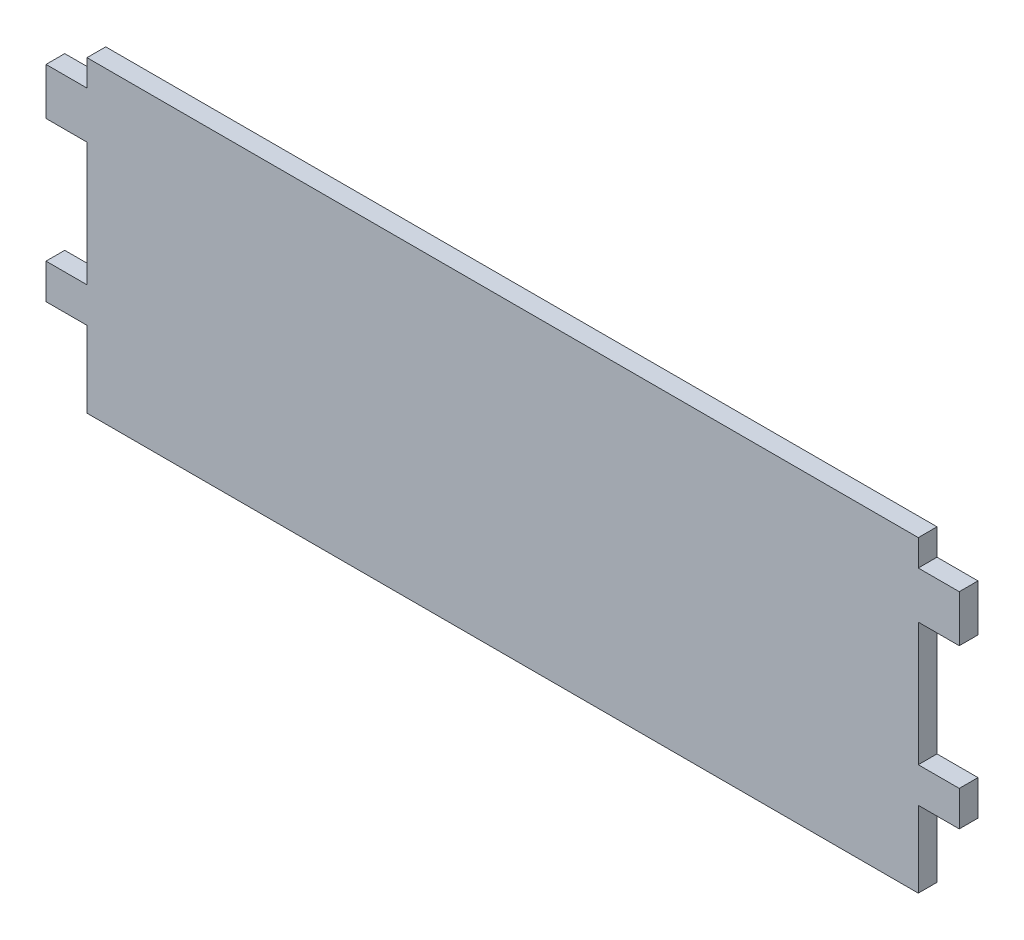
from build123d import *

# Parameters (mm, degrees)
EXTRUDE_528_DEPTH  = 1.6
SKETCH_3_W         = 71
SKETCH_3_H         = 2.25
SKETCH_3_H_2       = 6.5
EXTRUDE_1001_DEPTH = 1.6
LOGO_DEPTH         = 44.881231751
LOGO_DEPTH_BACK    = 1


with BuildPart() as part:
    # 草图1 → Extrude 528 (new body)
    with BuildSketch(Plane.XY):
        Polygon((39, 4), (-39, 4), (-39, 0), (-35.5, 0), (-35.5, -10.55), (-39, -10.55), (-39, -13.55), (-35.5, -13.55), (35.5, -13.55), (39, -13.55), (39, -10.55), (35.5, -10.55), (35.5, 0), (39, 0), align=None)
    extrude(amount=EXTRUDE_528_DEPTH)

    # 草图3 → Extrude 1001 (add)
    with BuildSketch(Plane(origin=(0, 0, 0), x_dir=(-1, 0, 0), z_dir=(0, 0, -1))):
        with Locations((0, 5.125)):
            Rectangle(SKETCH_3_W, SKETCH_3_H)
        with Locations((0, -16.8)):
            Rectangle(SKETCH_3_W, SKETCH_3_H_2)
    extrude(amount=-EXTRUDE_1001_DEPTH)

    # 草图4 → Logo-看看能不能刻字 (cut, two sides: drawn at the far end of the back side and taken through both)
    # profile 1 of 12: a face of its own
    with BuildSketch(Plane(origin=(0, 0, 0), x_dir=(-1, 0, 0), z_dir=(0, 0, -1)).offset(-LOGO_DEPTH_BACK)):
        with BuildLine():
            add(Edge.make_bspline(
                [(-27.459929342, -8.691409446), (-27.436001925, -8.617572138), (-27.394539976, -8.489625245), (-27.323277625, -8.339007395), (-27.281090522, -8.230603915), (-27.233908825, -8.203150774), (-27.218203793, -8.194012644)],
                knots=[0, 0, 0, 0, 1.648085737, 2.8558388, 3.6191513, 4, 4, 4, 4], degree=3))
            add(Edge.make_bspline(
                [(-27.218203793, -8.194012644), (-27.205694887, -8.194458457), (-27.182063614, -8.195300666), (-27.159622683, -8.228581969), (-27.164268885, -8.272899245), (-27.174766605, -8.303583709), (-27.181015247, -8.321848271)],
                knots=[0, 0, 0, 0, 0.863039544, 1.630416283, 2.589533502, 4, 4, 4, 4], degree=3))
            add(Edge.make_bspline(
                [(-27.181015247, -8.321848271), (-27.185533613, -8.344342612), (-27.19697186, -8.401287065), (-27.22261728, -8.505108049), (-27.269023279, -8.642468985), (-27.302092589, -8.747129654), (-27.320472295, -8.805299368)],
                knots=[0, 0, 0, 0, 0.546762329, 1.384129507, 2.546116346, 4, 4, 4, 4], degree=3))
            add(Edge.make_bspline(
                [(-27.320472295, -8.805299368), (-27.343190935, -8.866802308), (-27.383136679, -8.974941736), (-27.441037201, -9.111123092), (-27.484056211, -9.204859397), (-27.521287439, -9.241184175), (-27.534306434, -9.253886203)],
                knots=[0, 0, 0, 0, 1.569661668, 2.759905689, 3.566364542, 4, 4, 4, 4], degree=3))
            add(Edge.make_bspline(
                [(-27.534306434, -9.253886203), (-27.544082078, -9.250819393), (-27.577319827, -9.240392064), (-27.567092734, -9.201977146), (-27.559873559, -9.174860543)],
                knots=[0, 0, 0, 0, 0.588225419, 2, 2, 2, 2], degree=3))
            add(Edge.make_bspline(
                [(-27.559873559, -9.174860543), (-27.558029753, -9.146912378), (-27.553752567, -9.082079386), (-27.53332314, -8.973571085), (-27.503272392, -8.839968226), (-27.4752555, -8.743940021), (-27.459929342, -8.691409446)],
                knots=[0, 0, 0, 0, 0.678817279, 1.574692141, 2.673277134, 4, 4, 4, 4], degree=3))
        make_face()
    # profile 2 of 12: a face of its own
    with BuildSketch(Plane(origin=(0, 0, 0), x_dir=(-1, 0, 0), z_dir=(0, 0, -1)).offset(-LOGO_DEPTH_BACK)):
        with BuildLine():
            add(Edge.make_bspline(
                [(-26.723131276, -6.329936779), (-26.702468907, -6.336923043), (-26.653377818, -6.353521492), (-26.651528556, -6.462077682), (-26.668952163, -6.593075335), (-26.702960172, -6.700726805), (-26.723131276, -6.76457791)],
                knots=[0, 0, 0, 0, 0.505645468, 1.201347546, 2.340040755, 4, 4, 4, 4], degree=3))
            add(Edge.make_bspline(
                [(-26.723131276, -6.76457791), (-26.736502597, -6.803250522), (-26.767651535, -6.893339659), (-26.795538283, -6.984494436), (-26.811454072, -7.036519152)],
                knots=[0, 0, 0, 0, 0.858541084, 2, 2, 2, 2], degree=3))
            add(Edge.make_bspline(
                [(-26.811454072, -7.036519152), (-26.83596227, -7.107743686), (-26.878389606, -7.231043947), (-26.944533226, -7.3797822), (-26.990917826, -7.483297162), (-27.037571724, -7.510776975), (-27.053179621, -7.519970249)],
                knots=[0, 0, 0, 0, 1.63796548, 2.835561834, 3.610441321, 4, 4, 4, 4], degree=3))
            add(Edge.make_bspline(
                [(-27.053179621, -7.519970249), (-27.056911287, -7.511532739), (-27.069304008, -7.483512093), (-27.051281941, -7.418442196), (-27.031306472, -7.320854425), (-27.00550457, -7.244087531), (-26.990423949, -7.199219041)],
                knots=[0, 0, 0, 0, 0.327922845, 1.089019074, 2.298598366, 4, 4, 4, 4], degree=3))
            add(Edge.make_bspline(
                [(-26.990423949, -7.199219041), (-26.963163828, -7.105796605), (-26.908238474, -6.917563385), (-26.866184383, -6.681987185), (-26.838725019, -6.506603741), (-26.805414242, -6.415762956), (-26.775051168, -6.346378227), (-26.738238261, -6.334720701), (-26.723131276, -6.329936779)],
                knots=[0, 0, 0, 0, 1.88057729, 3.789101779, 4.644829705, 5.280277669, 5.704646114, 6, 6, 6, 6], degree=3))
        make_face()
    # profile 3 of 12: a face of its own
    with BuildSketch(Plane(origin=(0, 0, 0), x_dir=(-1, 0, 0), z_dir=(0, 0, -1)).offset(-LOGO_DEPTH_BACK)):
        with BuildLine():
            add(Edge.make_bspline(
                [(-22.093157308, -0.28912235), (-22.072765578, -0.262870492), (-22.02995152, -0.207752627), (-21.913892266, -0.182443523), (-21.776656459, -0.192866632), (-21.62233149, -0.241316889), (-21.469598856, -0.299063074), (-21.352192062, -0.376353011), (-21.269441799, -0.462153435), (-21.258984977, -0.531112231), (-21.25409074, -0.563387877)],
                knots=[0, 0, 0, 0, 0.754613421, 1.584370927, 2.616658453, 3.9681018, 5.338412071, 6.406821847, 7.25432497, 8, 8, 8, 8], degree=3))
            add(Edge.make_bspline(
                [(-21.25409074, -0.563387877), (-21.255089456, -0.582991604), (-21.256922063, -0.618963691), (-21.279149167, -0.668026701), (-21.319086945, -0.701986893), (-21.369539951, -0.719054416), (-21.423411258, -0.722623219), (-21.476356238, -0.705068031), (-21.520585887, -0.665402074), (-21.563833093, -0.598425488), (-21.602555978, -0.52134367), (-21.681844672, -0.488145703), (-21.727342432, -0.513276562), (-21.74730941, -0.54969788), (-21.761901879, -0.598688523), (-21.762669038, -0.636818191), (-21.763108962, -0.658683525)],
                knots=[0, 0, 0, 0, 1.005539938, 1.845127179, 2.694158893, 3.629015442, 4.548390316, 5.432391274, 6.424358395, 7.543253886, 9.540008515, 10.790812336, 11.380446912, 12.045099316, 12.87896853, 14, 14, 14, 14], degree=3))
            add(Edge.make_bspline(
                [(-21.763108962, -0.658683525), (-21.764956286, -0.682187867), (-21.768583138, -0.728333949), (-21.796250095, -0.794244057), (-21.841298906, -0.853157125), (-21.881598159, -0.884237724), (-21.90256601, -0.900409074)],
                knots=[0, 0, 0, 0, 0.969429021, 1.903280354, 2.909069021, 4, 4, 4, 4], degree=3))
            add(Edge.make_bspline(
                [(-21.90256601, -0.900409074), (-21.946330365, -0.941090286), (-22.049106316, -1.036625803), (-22.204207385, -1.200266775), (-22.36469796, -1.382026144), (-22.479397717, -1.536522208), (-22.5531987, -1.645682457), (-22.583808808, -1.706800944), (-22.608911599, -1.750938625), (-22.602228619, -1.775057204), (-22.599851246, -1.78363704)],
                knots=[0, 0, 0, 0, 1.256266656, 2.950209145, 4.740458408, 6.346969438, 7.006793011, 7.487924903, 7.81783669, 8, 8, 8, 8], degree=3))
            add(Edge.make_bspline(
                [(-22.599851246, -1.78363704), (-22.586750763, -1.7898852), (-22.549980004, -1.80742269), (-22.473374757, -1.767026362), (-22.374994439, -1.70859317), (-22.255547104, -1.613432741), (-22.127469186, -1.516038291), (-22.000091873, -1.441186956), (-21.884467739, -1.391048836), (-21.809201338, -1.384524117), (-21.774730383, -1.381535887)],
                knots=[0, 0, 0, 0, 0.35535966, 0.997432259, 1.987938317, 3.367764827, 4.83440807, 6.088704924, 7.124653701, 8, 8, 8, 8], degree=3))
            add(Edge.make_bspline(
                [(-21.774730383, -1.381535887), (-21.731861418, -1.38374956), (-21.643036995, -1.388336286), (-21.510024748, -1.428729162), (-21.374221705, -1.48978588), (-21.240544058, -1.572565829), (-21.116304893, -1.667508572), (-21.014273023, -1.774406323), (-20.933891155, -1.886098073), (-20.902282333, -1.968749747), (-20.886853849, -2.009092599)],
                knots=[0, 0, 0, 0, 0.896258184, 1.857045421, 2.888556501, 4.010215475, 5.143205214, 6.153302078, 7.09861402, 8, 8, 8, 8], degree=3))
            add(Edge.make_bspline(
                [(-20.886853849, -2.009092599), (-20.865309023, -2.095585675), (-20.818163436, -2.284854638), (-20.773960285, -2.60108142), (-20.731184409, -2.969823225), (-20.702123449, -3.380152827), (-20.677044313, -3.803142669), (-20.671852016, -4.214037346), (-20.673926848, -4.59862478), (-20.689002564, -4.846306392), (-20.696262551, -4.965582001)],
                knots=[0, 0, 0, 0, 0.719363741, 1.574151801, 2.575292707, 3.717343219, 4.895231715, 5.996539139, 7.035196786, 8, 8, 8, 8], degree=3))
            add(Edge.make_bspline(
                [(-20.696262551, -4.965582001), (-20.709247452, -5.082698426), (-20.733645339, -5.302753495), (-20.782197681, -5.609881337), (-20.836215047, -5.872749893), (-20.898391558, -6.090355546), (-20.965394996, -6.266216626), (-21.044295636, -6.3947469), (-21.126967077, -6.490636476), (-21.196863783, -6.512809192), (-21.228523615, -6.522852361)],
                knots=[0, 0, 0, 0, 1.653674163, 3.107159251, 4.363386933, 5.41647377, 6.284800608, 6.987952507, 7.541591371, 8, 8, 8, 8], degree=3))
            add(Edge.make_bspline(
                [(-21.228523615, -6.522852361), (-21.253455592, -6.528515622), (-21.297761821, -6.538579714), (-21.355593463, -6.558937696), (-21.396590481, -6.583316839), (-21.421661628, -6.613768922), (-21.427158794, -6.65064978), (-21.408755171, -6.687676498), (-21.377988928, -6.727892562), (-21.347807626, -6.751352019), (-21.330792116, -6.76457791)],
                knots=[0, 0, 0, 0, 1.523351432, 2.707124192, 3.642266241, 4.33501685, 4.988148388, 5.734263628, 6.722630992, 8, 8, 8, 8], degree=3))
            add(Edge.make_bspline(
                [(-21.330792116, -6.76457791), (-21.294200163, -6.787488887), (-21.210041951, -6.840182079), (-21.116416556, -6.873552538), (-21.063499442, -6.892413537)],
                knots=[0, 0, 0, 0, 0.869599124, 2, 2, 2, 2], degree=3))
            add(Edge.make_bspline(
                [(-21.063499442, -6.892413537), (-21.004250518, -6.918139208), (-20.888450814, -6.968419025), (-20.737838098, -7.07853772), (-20.618145873, -7.215984071), (-20.52651046, -7.377351544), (-20.461011514, -7.567116814), (-20.420805156, -7.786282509), (-20.405705318, -8.037404755), (-20.413313987, -8.214172239), (-20.417348457, -8.307902566)],
                knots=[0, 0, 0, 0, 0.918496198, 1.795164864, 2.632287514, 3.497761228, 4.423132691, 5.479805849, 6.663676054, 8, 8, 8, 8], degree=3))
            Line((-20.417348457, -8.307902566), (-20.494049833, -9.126050576))
            add(Edge.make_bspline(
                [(-20.494049833, -9.126050576), (-20.494758246, -9.163076186), (-20.496054105, -9.230804944), (-20.449148116, -9.309039628), (-20.383916965, -9.344372586), (-20.313593202, -9.367988723), (-20.221604745, -9.394704087), (-20.151775794, -9.407263645), (-20.112867237, -9.414261807)],
                knots=[0, 0, 0, 0, 1.214291004, 2.221230754, 2.821653616, 3.644219401, 4.687363598, 6, 6, 6, 6], degree=3))
            add(Edge.make_bspline(
                [(-20.112867237, -9.414261807), (-19.976370982, -9.445235464), (-19.688126916, -9.510643654), (-19.251395836, -9.680084859), (-18.784804944, -9.903365259), (-18.474347204, -10.088724214), (-18.311547044, -10.185924135)],
                knots=[0, 0, 0, 0, 0.851665526, 1.798492824, 2.845557137, 4, 4, 4, 4], degree=3))
            add(Edge.make_bspline(
                [(-18.311547044, -10.185924135), (-18.245528037, -10.238293076), (-18.10306426, -10.351301095), (-17.895549245, -10.557025879), (-17.679519283, -10.809450031), (-17.496137812, -11.043715637), (-17.353674687, -11.243239686), (-17.258636664, -11.386869249), (-17.177240124, -11.519428538), (-17.107823586, -11.640569698), (-17.056423866, -11.753532433), (-17.022617161, -11.856873471), (-16.995487056, -11.947909989), (-16.992667465, -12.006452048), (-16.991353663, -12.033730011)],
                knots=[0, 0, 0, 0, 1.311362238, 2.829815654, 4.540010041, 6.48255158, 7.459983283, 8.356658563, 9.163553602, 9.881806151, 10.529756853, 11.090541919, 11.576233486, 12, 12, 12, 12], degree=3))
            add(Edge.make_bspline(
                [(-16.991353663, -12.033730011), (-16.992212312, -12.076360786), (-16.993810183, -12.155692887), (-17.005975099, -12.26539577), (-17.03170826, -12.355540192), (-17.065314063, -12.427093488), (-17.110509771, -12.479774576), (-17.168677747, -12.509571823), (-17.235722122, -12.518632962), (-17.310940482, -12.503811692), (-17.395176312, -12.473189705), (-17.488586899, -12.419500204), (-17.592059561, -12.348099943), (-17.703618225, -12.255092984), (-17.828215672, -12.146445599), (-17.958707415, -12.013154777), (-18.100838286, -11.861640367), (-18.197874613, -11.753468564), (-18.248791372, -11.696708814)],
                knots=[0, 0, 0, 0, 1.062370866, 1.976978218, 2.740609457, 3.388054301, 3.934709773, 4.435474865, 4.981448296, 5.58757717, 6.326408542, 7.207610336, 8.262413484, 9.456242789, 10.82363104, 12.379655318, 14.100338032, 16, 16, 16, 16], degree=3))
            add(Edge.make_bspline(
                [(-18.248791372, -11.696708814), (-18.336803742, -11.594240229), (-18.502296749, -11.401564652), (-18.750026424, -11.146372761), (-18.976162022, -10.939153491), (-19.187493157, -10.773656296), (-19.401788857, -10.639860594), (-19.633368251, -10.526515896), (-19.88925201, -10.426432725), (-20.070565908, -10.373551009), (-20.164001488, -10.34629974)],
                knots=[0, 0, 0, 0, 1.356713968, 2.551080882, 3.570426766, 4.435994916, 5.24367471, 6.103414525, 7.022642149, 8, 8, 8, 8], degree=3))
            add(Edge.make_bspline(
                [(-20.164001488, -10.34629974), (-20.184431561, -10.343342486), (-20.233536919, -10.336234484), (-20.277680627, -10.313241127), (-20.303458535, -10.299814057)],
                knots=[0, 0, 0, 0, 0.832091392, 2, 2, 2, 2], degree=3))
            add(Edge.make_bspline(
                [(-20.303458535, -10.299814057), (-20.368312215, -10.283480852), (-20.484161429, -10.254304574), (-20.641205104, -10.226154154), (-20.759344289, -10.22065753), (-20.854753614, -10.237641897), (-20.92962491, -10.307646765), (-21.00110299, -10.420938425), (-21.095512275, -10.581537855), (-21.156809177, -10.70909401), (-21.191335069, -10.78094087)],
                knots=[0, 0, 0, 0, 1.340056946, 2.393766135, 3.185399246, 3.712368113, 4.274712892, 5.165954863, 6.403705055, 8, 8, 8, 8], degree=3))
            add(Edge.make_bspline(
                [(-21.191335069, -10.78094087), (-21.205988443, -10.808868047), (-21.231271851, -10.857054504), (-21.257154478, -10.904921512), (-21.268036445, -10.925046486)],
                knots=[0, 0, 0, 0, 1.15912969, 2, 2, 2, 2], degree=3))
            add(Edge.make_bspline(
                [(-21.268036445, -10.925046486), (-21.299900105, -10.983301111), (-21.363930482, -11.100364426), (-21.488508555, -11.262007959), (-21.632082765, -11.415991688), (-21.793712318, -11.551927796), (-21.955146392, -11.662716141), (-22.101162693, -11.741527836), (-22.232986111, -11.779194236), (-22.311586003, -11.767142704), (-22.346504277, -11.761788769)],
                knots=[0, 0, 0, 0, 1.11087343, 2.23231247, 3.407663767, 4.632499158, 5.762915838, 6.680068325, 7.41361579, 8, 8, 8, 8], degree=3))
            add(Edge.make_bspline(
                [(-22.346504277, -11.761788769), (-22.374962901, -11.756015), (-22.426249109, -11.745609904), (-22.499333986, -11.746374615), (-22.557418449, -11.776723023), (-22.586955412, -11.826302437), (-22.622548865, -11.876689052), (-22.694790197, -11.886952658), (-22.78053543, -11.868606569), (-22.879285524, -11.827266964), (-22.976249695, -11.783299451), (-23.052494524, -11.74510792), (-23.101244224, -11.722875122), (-23.125110074, -11.715223722), (-23.132112309, -11.712978803)],
                knots=[0, 0, 0, 0, 1.200180119, 2.162883465, 2.965278233, 3.765754158, 4.536874683, 5.391249155, 6.559834346, 8.171317839, 9.79041768, 10.964691581, 11.696240744, 12, 12, 12, 12], degree=3))
            add(Edge.make_bspline(
                [(-23.132112309, -11.712978803), (-23.14543372, -11.713957707), (-23.176364629, -11.71623062), (-23.225910485, -11.692655907), (-23.284131017, -11.656992657), (-23.354130335, -11.606354571), (-23.429684664, -11.534105737), (-23.518219627, -11.449795595), (-23.613791221, -11.34536652), (-23.680020184, -11.269942258), (-23.715507624, -11.229527705)],
                knots=[0, 0, 0, 0, 0.40836823, 0.948187912, 1.648533648, 2.542191079, 3.613514052, 4.887568217, 6.332266912, 8, 8, 8, 8], degree=3))
            add(Edge.make_bspline(
                [(-23.715507624, -11.229527705), (-23.749738345, -11.190925056), (-23.814187362, -11.118244647), (-23.902338394, -11.014446494), (-23.986839673, -10.932918732), (-24.050993524, -10.85837335), (-24.110786587, -10.806745997), (-24.1543562, -10.765121595), (-24.187916691, -10.740602016), (-24.229736987, -10.72516965), (-24.290512563, -10.776413509), (-24.379950115, -10.852793166), (-24.513458915, -10.992634382), (-24.611815133, -11.103130811), (-24.668464113, -11.166772034)],
                knots=[0, 0, 0, 0, 1.385500751, 2.608597147, 3.653070632, 4.536126925, 5.242792444, 5.773148675, 6.148167161, 6.36534937, 6.905007257, 8.010663756, 9.702312762, 12, 12, 12, 12], degree=3))
            add(Edge.make_bspline(
                [(-24.668464113, -11.166772034), (-24.702450312, -11.204806214), (-24.766368521, -11.276337503), (-24.858148625, -11.376255835), (-24.948235193, -11.454287916), (-25.027837793, -11.521928408), (-25.104893374, -11.5670913), (-25.173252257, -11.60134603), (-25.237343156, -11.612087849), (-25.295817255, -11.612435386), (-25.3474881, -11.589398258), (-25.390228848, -11.549349267), (-25.428799668, -11.494754634), (-25.453981444, -11.420417679), (-25.47778638, -11.332900246), (-25.49280462, -11.227559702), (-25.505403983, -11.106644044), (-25.505274479, -11.019611133), (-25.505206396, -10.973856452)],
                knots=[0, 0, 0, 0, 1.631619399, 3.068604095, 4.331916682, 5.442405316, 6.398435266, 7.185816095, 7.866130743, 8.461261034, 9.027317038, 9.623992456, 10.318151486, 11.141730531, 12.115257075, 13.219092696, 14.538029758, 16, 16, 16, 16], degree=3))
            add(Edge.make_bspline(
                [(-25.505206396, -10.973856452), (-25.502076362, -10.948143817), (-25.494912733, -10.889295963), (-25.463148233, -10.793990209), (-25.406413171, -10.683304756), (-25.33048915, -10.555631346), (-25.233712427, -10.409675389), (-25.114998531, -10.24826475), (-24.97562579, -10.069104012), (-24.763758788, -9.815773143), (-24.508739777, -9.495697203), (-24.230677127, -9.123499328), (-24.007744813, -8.768941489), (-23.829002373, -8.442293029), (-23.690689218, -8.150324127), (-23.555659509, -7.918244691), (-23.448833009, -7.733770476), (-23.370219443, -7.639326189), (-23.336649312, -7.598995909)],
                knots=[0, 0, 0, 0, 0.307756034, 0.704353418, 1.186834959, 1.786180581, 2.471558521, 3.270147962, 4.170241501, 5.172587356, 7.200156592, 9.040720478, 10.698396505, 12.179747532, 13.470448194, 14.539811119, 15.376459623, 16, 16, 16, 16], degree=3))
            add(Edge.make_bspline(
                [(-23.336649312, -7.598995909), (-23.312495846, -7.568907712), (-23.268559674, -7.514176015), (-23.210817215, -7.438251767), (-23.173385232, -7.371940054), (-23.148939993, -7.319364644), (-23.138337257, -7.277843323), (-23.147213089, -7.241806962), (-23.182469223, -7.228548642), (-23.206600194, -7.229111839), (-23.220435106, -7.229434734)],
                knots=[0, 0, 0, 0, 1.904158496, 3.463744486, 4.696335156, 5.654913314, 6.314710317, 6.798172154, 7.310960868, 8, 8, 8, 8], degree=3))
            add(Edge.make_bspline(
                [(-23.220435106, -7.229434734), (-23.263853994, -7.239825386), (-23.362933821, -7.263536357), (-23.510546352, -7.357493943), (-23.686595191, -7.481633313), (-23.804260534, -7.588880285), (-23.868910376, -7.647805876)],
                knots=[0, 0, 0, 0, 0.68225723, 1.556878377, 2.657655494, 4, 4, 4, 4], degree=3))
            add(Edge.make_bspline(
                [(-23.868910376, -7.647805876), (-23.921304183, -7.692611757), (-24.030632201, -7.78610636), (-24.224330544, -7.90391951), (-24.447916675, -8.007454487), (-24.687689201, -8.092118413), (-24.915521249, -8.159149808), (-25.106019228, -8.181345734), (-25.258369541, -8.185541172), (-25.325779502, -8.135873929), (-25.354127929, -8.114986984)],
                knots=[0, 0, 0, 0, 1.013831001, 2.11551976, 3.325106374, 4.635116236, 5.863866128, 6.79498304, 7.493245002, 8, 8, 8, 8], degree=3))
            add(Edge.make_bspline(
                [(-25.354127929, -8.114986984), (-25.37142752, -8.088417515), (-25.408172847, -8.031982434), (-25.444607985, -7.930006176), (-25.464431314, -7.810523784), (-25.466777566, -7.725363561), (-25.468017851, -7.680345853)],
                knots=[0, 0, 0, 0, 0.830609338, 1.764262045, 2.818136062, 4, 4, 4, 4], degree=3))
            add(Edge.make_bspline(
                [(-25.468017851, -7.680345853), (-25.465876196, -7.64842792), (-25.461980743, -7.590372429), (-25.443718969, -7.513305937), (-25.428766001, -7.451920144), (-25.400063908, -7.405403741), (-25.354664204, -7.373785965), (-25.29303451, -7.345517473), (-25.208879937, -7.327678291), (-25.146496293, -7.316754661), (-25.11240238, -7.310784678)],
                knots=[0, 0, 0, 0, 1.296213193, 2.357680561, 3.213636434, 3.850765539, 4.524158008, 5.425194629, 6.592817213, 8, 8, 8, 8], degree=3))
            add(Edge.make_bspline(
                [(-25.11240238, -7.310784678), (-25.062310055, -7.299126386), (-24.942783865, -7.271308327), (-24.749674107, -7.177841786), (-24.509285305, -7.04713925), (-24.287096107, -6.908658008), (-24.102183747, -6.784991947), (-23.973206881, -6.696373529), (-23.861394081, -6.615227092), (-23.766112588, -6.540791336), (-23.686316316, -6.474754321), (-23.626481725, -6.413563818), (-23.579634412, -6.363218664), (-23.55933438, -6.328711924), (-23.550483451, -6.313666791)],
                knots=[0, 0, 0, 0, 0.984903018, 2.35009467, 4.093831904, 6.244303721, 7.370462534, 8.364754309, 9.248311159, 10.02186813, 10.686525311, 11.233411575, 11.665763128, 12, 12, 12, 12], degree=3))
            add(Edge.make_bspline(
                [(-23.550483451, -6.313666791), (-23.544839845, -6.295088308), (-23.531602881, -6.25151285), (-23.559624358, -6.174603887), (-23.602905995, -6.083132369), (-23.679363221, -5.98151708), (-23.75647872, -5.855834259), (-23.81760034, -5.70311681), (-23.8667332, -5.530357503), (-23.897429752, -5.340003653), (-23.913187209, -5.141782474), (-23.913976594, -4.944271518), (-23.896004876, -4.750952998), (-23.868654456, -4.62601595), (-23.854964671, -4.563480848)],
                knots=[0, 0, 0, 0, 0.372757982, 0.874296352, 1.533925026, 2.377363609, 3.352626861, 4.422833688, 5.592442148, 6.87229383, 8.199413849, 9.491848645, 10.744587747, 12, 12, 12, 12], degree=3))
            add(Edge.make_bspline(
                [(-23.854964671, -4.563480848), (-23.839486338, -4.492342767), (-23.804666447, -4.332311312), (-23.76567104, -4.061085488), (-23.723149425, -3.733408423), (-23.68653795, -3.365303062), (-23.641900316, -2.995655402), (-23.585318179, -2.660659322), (-23.516275507, -2.378451106), (-23.453501594, -2.21239665), (-23.424972109, -2.136928226)],
                knots=[0, 0, 0, 0, 0.707056797, 1.590587311, 2.660445885, 3.917179782, 5.184015302, 6.276638538, 7.216766741, 8, 8, 8, 8], degree=3))
            add(Edge.make_bspline(
                [(-23.424972109, -2.136928226), (-23.409056701, -2.096021547), (-23.379280337, -2.019488656), (-23.34433746, -1.911800835), (-23.322008504, -1.820252384), (-23.313521027, -1.744893682), (-23.31887259, -1.684814982), (-23.33900555, -1.637833322), (-23.379404162, -1.61234529), (-23.409171211, -1.608847917), (-23.424972109, -1.606991447)],
                knots=[0, 0, 0, 0, 1.730525206, 3.237664378, 4.460376807, 5.442222482, 6.211419692, 6.826200897, 7.376925846, 8, 8, 8, 8], degree=3))
            add(Edge.make_bspline(
                [(-23.424972109, -1.606991447), (-23.444786893, -1.615568961), (-23.50421836, -1.641295928), (-23.599178564, -1.731742443), (-23.740238419, -1.864707136), (-23.902406297, -2.04453638), (-24.075948371, -2.226188136), (-24.244044262, -2.374585502), (-24.390935947, -2.481712882), (-24.554414337, -2.552329269), (-24.718346635, -2.584452934), (-24.839914311, -2.646241257), (-24.926583256, -2.668199195), (-24.989448693, -2.64352869), (-25.052530757, -2.594299346), (-25.090850709, -2.54851125), (-25.11240238, -2.52275939)],
                knots=[0, 0, 0, 0, 0.42756507, 1.282417164, 2.569090881, 4.303437118, 6.091571651, 7.566669329, 8.764153317, 9.68938524, 11.089405687, 12.051419372, 12.411365329, 12.816079731, 13.334146838, 14, 14, 14, 14], degree=3))
            add(Edge.make_bspline(
                [(-25.11240238, -2.52275939), (-25.135862425, -2.494267143), (-25.177158813, -2.444112641), (-25.249399779, -2.393826283), (-25.32058553, -2.372292634), (-25.39014165, -2.391502061), (-25.447423337, -2.445429521), (-25.49102526, -2.530475066), (-25.524327134, -2.644783716), (-25.535978769, -2.732469334), (-25.542394942, -2.780754927)],
                knots=[0, 0, 0, 0, 1.166925474, 2.054122484, 2.7643065, 3.450644732, 4.235354158, 5.193741752, 6.454685619, 8, 8, 8, 8], degree=3))
            add(Edge.make_bspline(
                [(-25.542394942, -2.780754927), (-25.552784592, -2.845914824), (-25.572386106, -2.968847999), (-25.606772219, -3.140317499), (-25.643323533, -3.286940893), (-25.685643928, -3.419960969), (-25.733006208, -3.568332893), (-25.78234734, -3.760141154), (-25.839223265, -4.007949225), (-25.894888559, -4.24237728), (-25.937291839, -4.440712712), (-25.971974405, -4.5763707), (-25.997045861, -4.694478911), (-26.026859366, -4.792753611), (-26.049529424, -4.872698288), (-26.066892589, -4.93489737), (-26.084854085, -4.976819061), (-26.108774573, -5.015153096), (-26.146688263, -5.07389669), (-26.190119145, -5.184685347), (-26.257438346, -5.345495845), (-26.303816258, -5.472009665), (-26.330327259, -5.544328747)],
                knots=[0, 0, 0, 0, 1.372877092, 2.590122882, 3.638013898, 4.515112899, 5.494147896, 6.878430871, 8.634183848, 10.785046913, 11.891919291, 12.853814495, 13.698458949, 14.402652342, 14.989480169, 15.428029669, 15.745584427, 15.933590646, 16.367672632, 17.197572504, 18.398048653, 20, 20, 20, 20], degree=3))
            add(Edge.make_bspline(
                [(-26.330327259, -5.544328747), (-26.349120251, -5.597238815), (-26.384195168, -5.695989257), (-26.441212544, -5.82972091), (-26.488573753, -5.942747212), (-26.534842366, -6.03230211), (-26.578749403, -6.098895145), (-26.6144637, -6.145882658), (-26.651484646, -6.173105792), (-26.67564322, -6.17062066), (-26.68594273, -6.169561175)],
                knots=[0, 0, 0, 0, 1.80810695, 3.374619722, 4.682165804, 5.75384867, 6.619091608, 7.239001278, 7.675563893, 8, 8, 8, 8], degree=3))
            add(Edge.make_bspline(
                [(-26.68594273, -6.169561175), (-26.696581325, -6.156894809), (-26.726755073, -6.120969791), (-26.724555395, -6.072867825), (-26.723131276, -6.041725549)],
                knots=[0, 0, 0, 0, 0.705155751, 2, 2, 2, 2], degree=3))
            add(Edge.make_bspline(
                [(-26.723131276, -6.041725549), (-26.718242702, -5.966295432), (-26.708249659, -5.812103928), (-26.622318853, -5.626448952), (-26.539749391, -5.455596085), (-26.48123338, -5.273844067), (-26.409209915, -5.048791051), (-26.344172789, -4.786409506), (-26.274387274, -4.517510135), (-26.20009359, -4.269112012), (-26.138544819, -4.050528329), (-26.06803541, -3.853700804), (-25.99963936, -3.646793762), (-25.940031895, -3.398121297), (-25.871277147, -3.099626457), (-25.831223088, -2.881670939), (-25.809687616, -2.764484939)],
                knots=[0, 0, 0, 0, 0.923111981, 1.886991978, 2.484764976, 3.263318292, 4.232097329, 5.39619892, 6.590411558, 7.653335902, 8.589181064, 9.385767399, 10.227638829, 11.271331935, 12.532903876, 14, 14, 14, 14], degree=3))
            add(Edge.make_bspline(
                [(-25.809687616, -2.764484939), (-25.791936687, -2.683157189), (-25.760446264, -2.538880506), (-25.718492607, -2.350264595), (-25.681053465, -2.220536044), (-25.654091933, -2.135890053), (-25.611048501, -2.090225449), (-25.553241858, -2.074223221), (-25.482302769, -2.082759516), (-25.431388294, -2.096634868), (-25.402937895, -2.104388248)],
                knots=[0, 0, 0, 0, 2.177058904, 3.862136078, 5.041728353, 5.722565464, 6.152210951, 6.619803522, 7.228762747, 8, 8, 8, 8], degree=3))
            add(Edge.make_bspline(
                [(-25.402937895, -2.104388248), (-25.350149792, -2.110054638), (-25.22728492, -2.123243221), (-25.017165291, -2.073759502), (-24.758548617, -1.993587661), (-24.521115229, -1.887225589), (-24.320400256, -1.794932243), (-24.182192515, -1.721658376), (-24.062225009, -1.653487216), (-23.960857568, -1.58723744), (-23.876403408, -1.52655973), (-23.813770195, -1.465330043), (-23.765746435, -1.409909263), (-23.748783107, -1.369625612), (-23.741074749, -1.351320193)],
                knots=[0, 0, 0, 0, 1.009079477, 2.348643213, 4.072780796, 6.196895368, 7.31019926, 8.29751409, 9.186835554, 9.946972449, 10.613593306, 11.168863734, 11.622320805, 12, 12, 12, 12], degree=3))
            add(Edge.make_bspline(
                [(-23.741074749, -1.351320193), (-23.735423353, -1.338579481), (-23.721479365, -1.307143644), (-23.678367992, -1.261843339), (-23.617373582, -1.206971823), (-23.539191836, -1.138749042), (-23.43812201, -1.065908919), (-23.318647762, -0.981703821), (-23.180497522, -0.885893164), (-23.024710136, -0.789607584), (-22.872028556, -0.689108262), (-22.726837885, -0.604569195), (-22.602000525, -0.529804388), (-22.495398588, -0.468135436), (-22.404890138, -0.423595213), (-22.331724697, -0.39420198), (-22.27737836, -0.371021522), (-22.245125048, -0.370625793), (-22.232614355, -0.370472295)],
                knots=[0, 0, 0, 0, 0.365672682, 0.90224361, 1.625545653, 2.539041464, 3.634725517, 4.910819704, 6.396329812, 8.069182418, 9.742035023, 11.217950171, 12.501065338, 13.581193363, 14.467996738, 15.155154963, 15.672294229, 16, 16, 16, 16], degree=3))
            add(Edge.make_bspline(
                [(-22.232614355, -0.370472295), (-22.217174323, -0.374303397), (-22.188205739, -0.381491311), (-22.144875488, -0.368698664), (-22.110842003, -0.336228242), (-22.099563343, -0.306185806), (-22.093157308, -0.28912235)],
                knots=[0, 0, 0, 0, 1.025349987, 1.923761483, 2.820741246, 4, 4, 4, 4], degree=3))
        make_face()
        with BuildLine():
            add(Edge.make_bspline(
                [(-22.992655262, -5.72097434), (-22.979354477, -5.729436145), (-22.956139871, -5.744205008), (-22.913928296, -5.745889527), (-22.880530965, -5.719388676), (-22.851080362, -5.666620632), (-22.834121406, -5.58312972), (-22.886132977, -5.516983451), (-22.934706379, -5.489685212), (-22.976090158, -5.483629091), (-23.009527229, -5.511824655), (-23.033737822, -5.5506886), (-23.051513734, -5.597914511), (-23.049282752, -5.646360947), (-23.028936808, -5.689735567), (-23.005228187, -5.710148926), (-22.992655262, -5.72097434)],
                knots=[0, 0, 0, 0, 0.923075548, 1.611095438, 2.336332082, 3.303918449, 5.198438684, 6.94202583, 7.824314286, 8.513861415, 9.239098058, 10.231374456, 11.246705758, 12.165211596, 13.026992939, 14, 14, 14, 14], degree=3))
        make_face(mode=Mode.SUBTRACT)
        with BuildLine():
            add(Edge.make_bspline(
                [(-21.55857196, -2.427463741), (-21.571511162, -2.394997894), (-21.595120304, -2.335760022), (-21.665162044, -2.272326432), (-21.756454449, -2.255432604), (-21.858730738, -2.285769615), (-21.974296254, -2.351832587), (-22.107286948, -2.454136095), (-22.254952725, -2.595058317), (-22.354993075, -2.704900865), (-22.409259948, -2.764484939)],
                knots=[0, 0, 0, 0, 0.746222013, 1.361572449, 1.940796494, 2.661200323, 3.609372225, 4.800759546, 6.264572507, 8, 8, 8, 8], degree=3))
            add(Edge.make_bspline(
                [(-22.409259948, -2.764484939), (-22.456390757, -2.81962659), (-22.538806732, -2.91605084), (-22.656377816, -3.030224927), (-22.741307687, -3.10577983), (-22.807581776, -3.135685674), (-22.85652469, -3.137794486), (-22.88495569, -3.170935578), (-22.903444659, -3.21465728), (-22.908578405, -3.262449454), (-22.895176105, -3.308374575), (-22.855233314, -3.333383992), (-22.801107697, -3.356812803), (-22.723357122, -3.372748941), (-22.625367707, -3.39059523), (-22.504557702, -3.396942221), (-22.362894334, -3.405256017), (-22.261304121, -3.405732746), (-22.207047229, -3.405987356)],
                knots=[0, 0, 0, 0, 2.355501657, 4.118982276, 5.338553429, 6.016815206, 6.456739817, 6.848604409, 7.344790061, 8.001665156, 8.376141576, 8.824636953, 9.45639919, 10.311747483, 11.384321426, 12.698071615, 14.236519381, 16, 16, 16, 16], degree=3))
            Line((-22.207047229, -3.405987356), (-21.507437709, -3.405987356))
            Line((-21.507437709, -3.405987356), (-21.507437709, -3.006210487))
            add(Edge.make_bspline(
                [(-21.507437709, -3.006210487), (-21.507607421, -2.944207783), (-21.507923743, -2.828642147), (-21.517052199, -2.669653381), (-21.531108165, -2.537852813), (-21.550123476, -2.461421914), (-21.55857196, -2.427463741)],
                knots=[0, 0, 0, 0, 1.276627796, 2.379481746, 3.28000535, 4, 4, 4, 4], degree=3))
        make_face(mode=Mode.SUBTRACT)
        with BuildLine():
            add(Edge.make_bspline(
                [(-21.521383414, -4.258999628), (-21.520049166, -4.230311454), (-21.517639124, -4.178492185), (-21.532179, -4.108038104), (-21.566119499, -4.056719079), (-21.617267962, -4.028359446), (-21.680318444, -4.028719775), (-21.752963011, -4.051199434), (-21.830676491, -4.107052268), (-21.884391314, -4.152461022), (-21.91418743, -4.177649684)],
                knots=[0, 0, 0, 0, 1.132549536, 2.04571712, 2.792988952, 3.49166257, 4.257510687, 5.216226711, 6.455814835, 8, 8, 8, 8], degree=3))
            add(Edge.make_bspline(
                [(-21.91418743, -4.177649684), (-21.944113224, -4.202604327), (-22.00838465, -4.256199248), (-22.137600472, -4.30511466), (-22.295522844, -4.334484463), (-22.472711313, -4.338146904), (-22.64653006, -4.340894188), (-22.794011311, -4.370867771), (-22.910765577, -4.417388414), (-22.959232768, -4.473266374), (-22.981033842, -4.498400893)],
                knots=[0, 0, 0, 0, 0.810532236, 1.740774684, 2.847143763, 4.161806061, 5.444087527, 6.471003401, 7.312240592, 8, 8, 8, 8], degree=3))
            add(Edge.make_bspline(
                [(-22.981033842, -4.498400893), (-22.998144595, -4.52811679), (-23.028692658, -4.58116899), (-23.05889166, -4.658759033), (-23.05836479, -4.728097583), (-23.02884796, -4.783439611), (-22.975188889, -4.816722557), (-22.90700116, -4.830690954), (-22.825795708, -4.817770067), (-22.769980121, -4.799161954), (-22.739308293, -4.788936408)],
                knots=[0, 0, 0, 0, 1.357538325, 2.423631794, 3.25169603, 4.01973352, 4.793254885, 5.670880972, 6.720100593, 8, 8, 8, 8], degree=3))
            add(Edge.make_bspline(
                [(-22.739308293, -4.788936408), (-22.696333213, -4.76923257), (-22.601808687, -4.725893596), (-22.437284668, -4.681307171), (-22.244042251, -4.633156566), (-22.103447577, -4.608980937), (-22.028077352, -4.596020826)],
                knots=[0, 0, 0, 0, 0.766270866, 1.685427697, 2.759200266, 4, 4, 4, 4], degree=3))
            add(Edge.make_bspline(
                [(-22.028077352, -4.596020826), (-21.981514492, -4.587921055), (-21.897362207, -4.573282475), (-21.785490483, -4.548090542), (-21.700182509, -4.523523789), (-21.636989291, -4.496204333), (-21.591698126, -4.456400851), (-21.560309187, -4.403340995), (-21.533719141, -4.336903598), (-21.525722657, -4.286403304), (-21.521383414, -4.258999628)],
                knots=[0, 0, 0, 0, 1.681929656, 3.039723592, 4.077641292, 4.842253386, 5.467367857, 6.186373749, 7.015846804, 8, 8, 8, 8], degree=3))
        make_face(mode=Mode.SUBTRACT)
        with BuildLine():
            add(Edge.make_bspline(
                [(-21.419114913, -8.210282633), (-21.411136451, -8.161613081), (-21.397357047, -8.077557093), (-21.400124846, -7.967832515), (-21.43846932, -7.887706374), (-21.521749742, -7.864420876), (-21.624544153, -7.901426918), (-21.760974188, -7.976345238), (-21.939610764, -8.099796414), (-22.069059737, -8.201699375), (-22.141967274, -8.259092599)],
                knots=[0, 0, 0, 0, 1.034514965, 1.786685413, 2.297944196, 2.761567413, 3.449038798, 4.534744062, 6.048317637, 8, 8, 8, 8], degree=3))
            add(Edge.make_bspline(
                [(-22.141967274, -8.259092599), (-22.192560942, -8.300615804), (-22.28511988, -8.376580719), (-22.408770799, -8.485029052), (-22.498589645, -8.582986851), (-22.564874365, -8.663426525), (-22.600171494, -8.731031644), (-22.611492239, -8.79096542), (-22.578752974, -8.83943168), (-22.543159719, -8.848827297), (-22.52314987, -8.854109334)],
                knots=[0, 0, 0, 0, 1.895473293, 3.467686844, 4.753286774, 5.744804387, 6.467120879, 6.962625906, 7.416808076, 8, 8, 8, 8], degree=3))
            add(Edge.make_bspline(
                [(-22.52314987, -8.854109334), (-22.506155595, -8.857623025), (-22.464793641, -8.866174914), (-22.422534669, -8.867358028), (-22.397638527, -8.868055039)],
                knots=[0, 0, 0, 0, 0.821734595, 2, 2, 2, 2], degree=3))
            add(Edge.make_bspline(
                [(-22.397638527, -8.868055039), (-22.308350135, -8.869834009), (-22.128998387, -8.87340739), (-21.951956576, -8.902337466), (-21.86305318, -8.916865006)],
                knots=[0, 0, 0, 0, 0.995679093, 2, 2, 2, 2], degree=3))
            add(Edge.make_bspline(
                [(-21.86305318, -8.916865006), (-21.832372003, -8.925094406), (-21.776996221, -8.939947471), (-21.697348994, -8.943456861), (-21.632792922, -8.918369152), (-21.580918775, -8.865071104), (-21.547272067, -8.769395926), (-21.505814164, -8.63187222), (-21.463167822, -8.438626238), (-21.434967325, -8.292451936), (-21.419114913, -8.210282633)],
                knots=[0, 0, 0, 0, 0.777130081, 1.402625024, 1.912987653, 2.422293265, 3.169009719, 4.356347706, 5.951785185, 8, 8, 8, 8], degree=3))
        make_face(mode=Mode.SUBTRACT)
        with BuildLine():
            add(Edge.make_bspline(
                [(-21.990888806, -9.848902938), (-22.007935742, -9.833532414), (-22.052883365, -9.793004981), (-22.169725319, -9.772318478), (-22.330826273, -9.757590903), (-22.535716558, -9.751452509), (-22.754505874, -9.75741991), (-22.962713117, -9.77812668), (-23.147233286, -9.810322078), (-23.258732106, -9.847647961), (-23.311082187, -9.865172927)],
                knots=[0, 0, 0, 0, 0.401815209, 1.05946541, 2.027321044, 3.307470412, 4.683878449, 5.914575412, 7.020867243, 8, 8, 8, 8], degree=3))
            add(Edge.make_bspline(
                [(-23.311082187, -9.865172927), (-23.351035445, -9.881208761), (-23.423928721, -9.910465561), (-23.51825085, -9.964627972), (-23.583063902, -10.031528119), (-23.60521061, -10.082889064), (-23.615563406, -10.106898475)],
                knots=[0, 0, 0, 0, 1.283582359, 2.341849645, 3.2248738, 4, 4, 4, 4], degree=3))
            add(Edge.make_bspline(
                [(-23.615563406, -10.106898475), (-23.62294079, -10.140114228), (-23.639350413, -10.213996512), (-23.618241336, -10.340296132), (-23.576367524, -10.488114747), (-23.50434404, -10.645946816), (-23.422233846, -10.795066344), (-23.340547622, -10.913373945), (-23.2595841, -10.994825663), (-23.198133091, -11.014276126), (-23.171625139, -11.022666419)],
                knots=[0, 0, 0, 0, 0.751359994, 1.67126101, 2.80126612, 4.17590743, 5.519361271, 6.581944765, 7.38829746, 8, 8, 8, 8], degree=3))
            add(Edge.make_bspline(
                [(-23.171625139, -11.022666419), (-23.142273859, -11.027827112), (-23.082204492, -11.038388817), (-22.987136612, -11.029676126), (-22.889076861, -11.002631547), (-22.785935434, -10.961178591), (-22.681183166, -10.897688486), (-22.569110746, -10.822389945), (-22.455248586, -10.724370684), (-22.33921953, -10.615511434), (-22.229851785, -10.500352305), (-22.138052248, -10.386723287), (-22.060847277, -10.282373038), (-22.007347839, -10.182831286), (-21.972514651, -10.089674589), (-21.958220778, -10.003038975), (-21.96035291, -9.92065962), (-21.980828938, -9.872542747), (-21.990888806, -9.848902938)],
                knots=[0, 0, 0, 0, 0.768375059, 1.572531201, 2.442929509, 3.395981474, 4.437878152, 5.605640024, 6.886491761, 8.318878311, 9.722926027, 10.99100598, 12.097989291, 13.075605259, 13.906311568, 14.65776232, 15.34055893, 16, 16, 16, 16], degree=3))
        make_face(mode=Mode.SUBTRACT)
    # profile 4 of 12: a face of its own
    with BuildSketch(Plane(origin=(0, 0, 0), x_dir=(-1, 0, 0), z_dir=(0, 0, -1)).offset(-LOGO_DEPTH_BACK)):
        with BuildLine():
            add(Edge.make_bspline(
                [(-21.723596132, 1.042692451), (-21.619138536, 1.063548554), (-21.421618975, 1.102985497), (-21.139480081, 1.148072661), (-20.888846323, 1.175445892), (-20.670242235, 1.192020377), (-20.482321999, 1.18848627), (-20.326960396, 1.167622232), (-20.1977476, 1.137653713), (-20.131461468, 1.094777143), (-20.101245816, 1.075232428)],
                knots=[0, 0, 0, 0, 1.545447559, 2.922297032, 4.143815547, 5.202636796, 6.10221214, 6.862135827, 7.481319749, 8, 8, 8, 8], degree=3))
            add(Edge.make_bspline(
                [(-20.101245816, 1.075232428), (-20.09416241, 1.067122176), (-20.077061554, 1.047542294), (-20.074050664, 0.997785213), (-20.082709905, 0.933773474), (-20.10656182, 0.82841899), (-20.151646997, 0.69836101), (-20.220514741, 0.615916285), (-20.252324284, 0.577835627)],
                knots=[0, 0, 0, 0, 0.346431106, 0.836358675, 1.553603808, 2.492895477, 4.380092264, 6, 6, 6, 6], degree=3))
            add(Edge.make_bspline(
                [(-20.252324284, 0.577835627), (-20.265297115, 0.571063493), (-20.302238449, 0.551779217), (-20.382531912, 0.54155059), (-20.497393892, 0.52622874), (-20.649745563, 0.516262657), (-20.838712874, 0.507050903), (-21.065004345, 0.499636541), (-21.32846984, 0.499139939), (-21.617454481, 0.496141108), (-21.908785567, 0.495087488), (-22.180136178, 0.489551427), (-22.42019925, 0.473943128), (-22.629052972, 0.460111393), (-22.80593139, 0.436823755), (-22.950478487, 0.409813774), (-23.064329445, 0.379184561), (-23.169031551, 0.330473169), (-23.266389962, 0.267204991), (-23.373026342, 0.216901295), (-23.463969794, 0.182889951), (-23.540346716, 0.175464794), (-23.600494341, 0.173057171), (-23.647473397, 0.152361619), (-23.673408075, 0.111411332), (-23.67659186, 0.080784194), (-23.678319078, 0.064168836)],
                knots=[0, 0, 0, 0, 0.295088751, 0.840292489, 1.615634052, 2.655199719, 3.928935129, 5.453144559, 7.24369624, 9.269829753, 11.311668788, 13.14987353, 14.770332854, 16.188140977, 17.392084722, 18.383927593, 19.169227066, 19.773652638, 20.716535392, 21.517386859, 22.163053953, 22.669556893, 23.065023603, 23.381100543, 23.664244295, 24, 24, 24, 24], degree=3))
            add(Edge.make_bspline(
                [(-23.678319078, 0.064168836), (-23.683288711, 0.041187015), (-23.695911047, -0.017184352), (-23.762689852, -0.10603866), (-23.860937728, -0.217456996), (-23.989457582, -0.341660085), (-24.125792123, -0.46362549), (-24.256933852, -0.558730043), (-24.369053715, -0.630368374), (-24.444732904, -0.650060392), (-24.477872815, -0.658683525)],
                knots=[0, 0, 0, 0, 0.505218207, 1.283200232, 2.354337613, 3.743782836, 5.148269171, 6.313851694, 7.261635801, 8, 8, 8, 8], degree=3))
            Line((-24.477872815, -0.658683525), (-24.694031238, -0.723763481))
            add(Edge.make_bspline(
                [(-24.694031238, -0.723763481), (-24.708738998, -0.724488435), (-24.742910972, -0.726172791), (-24.802715324, -0.730506134), (-24.880757351, -0.765805205), (-24.939953814, -0.827480048), (-25.002332304, -0.877106565), (-25.061354272, -0.897472861), (-25.125738079, -0.893445878), (-25.187581118, -0.871504753), (-25.241456906, -0.848668703), (-25.292436535, -0.842259961), (-25.325826779, -0.873918196), (-25.327572235, -0.901217599), (-25.328560803, -0.916679063)],
                knots=[0, 0, 0, 0, 0.721920863, 1.677309203, 2.917887445, 4.802872387, 5.835042234, 6.794940693, 7.782196375, 8.934324472, 9.978283003, 10.699206048, 11.263274024, 12, 12, 12, 12], degree=3))
            add(Edge.make_bspline(
                [(-25.328560803, -0.916679063), (-25.329393409, -0.9339801), (-25.330933538, -0.965983045), (-25.355494726, -1.008791591), (-25.401245104, -1.027496), (-25.457862212, -1.02756217), (-25.52890236, -1.012237611), (-25.613347361, -0.977587626), (-25.715174065, -0.931294247), (-25.78527526, -0.890300246), (-25.823633321, -0.867869096)],
                knots=[0, 0, 0, 0, 0.689109886, 1.274694989, 1.857807519, 2.572308708, 3.521826147, 4.749610776, 6.221447886, 8, 8, 8, 8], degree=3))
            add(Edge.make_bspline(
                [(-25.823633321, -0.867869096), (-25.879156196, -0.831414645), (-25.9730968, -0.769736407), (-26.076117924, -0.685218693), (-26.13459776, -0.592407596), (-26.102799924, -0.54985035), (-26.088601711, -0.530847899)],
                knots=[0, 0, 0, 0, 1.642415761, 2.778846177, 3.454736404, 4, 4, 4, 4], degree=3))
            add(Edge.make_bspline(
                [(-26.088601711, -0.530847899), (-26.068029719, -0.520864027), (-26.020560984, -0.497826795), (-25.967556598, -0.498133906), (-25.937523243, -0.498307921)],
                knots=[0, 0, 0, 0, 0.86675965, 2, 2, 2, 2], degree=3))
            add(Edge.make_bspline(
                [(-25.937523243, -0.498307921), (-25.880981467, -0.492672201), (-25.754091777, -0.480024653), (-25.599805735, -0.404819008), (-25.452657126, -0.336884062), (-25.316146979, -0.278178121), (-25.156902775, -0.221528416), (-25.044241859, -0.182146723), (-24.984566753, -0.161286724)],
                knots=[0, 0, 0, 0, 1.000907177, 2.24621174, 3.002523313, 3.883086614, 4.878696947, 6, 6, 6, 6], degree=3))
            add(Edge.make_bspline(
                [(-24.984566753, -0.161286724), (-24.860992747, -0.118161725), (-24.608762431, -0.030138099), (-24.231310793, 0.123923839), (-23.846057049, 0.297862013), (-23.591739638, 0.429442976), (-23.462160655, 0.496485682)],
                knots=[0, 0, 0, 0, 0.945883157, 1.930668237, 2.945640779, 4, 4, 4, 4], degree=3))
            add(Edge.make_bspline(
                [(-23.462160655, 0.496485682), (-23.352356025, 0.550716359), (-23.11565638, 0.667618369), (-22.71098818, 0.804211293), (-22.24156686, 0.934562984), (-21.903066865, 1.005226869), (-21.723596132, 1.042692451)],
                knots=[0, 0, 0, 0, 0.803043632, 1.731075845, 2.797029587, 4, 4, 4, 4], degree=3))
        make_face()
    # profile 5 of 12: a face of its own
    with BuildSketch(Plane(origin=(0, 0, 0), x_dir=(-1, 0, 0), z_dir=(0, 0, -1)).offset(-LOGO_DEPTH_BACK)):
        with BuildLine():
            add(Edge.make_bspline(
                [(-12.015061361, -3.808088509), (-12.014598761, -3.786315304), (-12.013802477, -3.748836621), (-12.000268689, -3.701253009), (-11.968886661, -3.672112913), (-11.925585482, -3.679171046), (-11.880430206, -3.706916958), (-11.822005842, -3.750938166), (-11.755412935, -3.81996399), (-11.710130969, -3.875115721), (-11.685013016, -3.905708442)],
                knots=[0, 0, 0, 0, 1.00463066, 1.729292259, 2.237942206, 2.811675273, 3.580086643, 4.70386788, 6.171632163, 8, 8, 8, 8], degree=3))
            add(Edge.make_bspline(
                [(-11.685013016, -3.905708442), (-11.659915654, -3.934901163), (-11.605617561, -3.998059558), (-11.524875544, -4.105645843), (-11.43668383, -4.231844108), (-11.375733634, -4.322427237), (-11.34334325, -4.370565266)],
                knots=[0, 0, 0, 0, 0.799992324, 1.730781833, 2.79408348, 4, 4, 4, 4], degree=3))
            add(Edge.make_bspline(
                [(-11.34334325, -4.370565266), (-11.304929991, -4.42503251), (-11.233025851, -4.526987417), (-11.127676698, -4.666153882), (-11.037151394, -4.784678789), (-10.961325622, -4.882556303), (-10.89847658, -4.956933779), (-10.849201272, -5.012017207), (-10.816158, -5.043808556), (-10.787796659, -5.066089662), (-10.762256451, -5.048019014), (-10.748814593, -5.014493087), (-10.728475004, -4.963423228), (-10.70915777, -4.892464099), (-10.687670284, -4.800310213), (-10.66864889, -4.688186106), (-10.644171272, -4.555928315), (-10.620859107, -4.410792712), (-10.596156339, -4.265881234), (-10.573639978, -4.135480407), (-10.551067202, -4.026611354), (-10.52826049, -3.940961777), (-10.506508705, -3.875763152), (-10.49026297, -3.833627303), (-10.472238128, -3.802320873), (-10.439611696, -3.807067944), (-10.428856012, -3.854308871), (-10.417833337, -3.922423039), (-10.409483798, -4.035575119), (-10.40616199, -4.185131609), (-10.403844978, -4.375292418), (-10.403623545, -4.603758242), (-10.408644753, -4.872669933), (-10.422049304, -5.277032545), (-10.436862367, -5.793208791), (-10.465178418, -6.39446649), (-10.499177826, -6.960955475), (-10.529209987, -7.326326074), (-10.543789513, -7.50370026)],
                knots=[0, 0, 0, 0, 1.215283343, 2.274836986, 3.181854513, 3.936447164, 4.527944297, 4.967939105, 5.257808747, 5.415757678, 5.529656273, 5.757453461, 6.074926884, 6.530959122, 7.096407473, 7.800229045, 8.603877182, 9.549145784, 10.480482119, 11.284130255, 11.962979989, 12.504447724, 12.906520062, 13.197763501, 13.367879707, 13.481778301, 13.702906805, 14.132574351, 14.813039173, 15.731753582, 16.876158719, 18.274769528, 19.899664122, 21.77945549, 25.65244574, 29.315362851, 32.75485089, 36, 36, 36, 36], degree=3))
            add(Edge.make_bspline(
                [(-10.543789513, -7.50370026), (-10.573793536, -7.886250021), (-10.633320609, -8.645217152), (-10.649603681, -9.406337636), (-10.657679435, -9.783822983)],
                knots=[0, 0, 0, 0, 1.008079916, 2, 2, 2, 2], degree=3))
            add(Edge.make_bspline(
                [(-10.657679435, -9.783822983), (-10.659826451, -9.889968108), (-10.663729391, -10.082923324), (-10.67141661, -10.344936154), (-10.68601769, -10.550269911), (-10.699046, -10.705389187), (-10.71584416, -10.821683056), (-10.745193488, -10.907958254), (-10.774745824, -10.978092411), (-10.807698516, -11.008720047), (-10.822703607, -11.022666419)],
                knots=[0, 0, 0, 0, 2.005465131, 3.645621548, 4.95108623, 5.891828383, 6.589562832, 7.15882184, 7.616967404, 8, 8, 8, 8], degree=3))
            add(Edge.make_bspline(
                [(-10.822703607, -11.022666419), (-10.855711921, -11.042380543), (-10.91776718, -11.079442874), (-11.02677513, -11.092429627), (-11.132770739, -11.060543023), (-11.235358159, -10.987850976), (-11.334116298, -10.874808148), (-11.433141301, -10.723982439), (-11.533010908, -10.534964062), (-11.59105354, -10.392612473), (-11.622257345, -10.316084046)],
                knots=[0, 0, 0, 0, 0.745180155, 1.400930292, 2.077180244, 2.86283137, 3.827792053, 4.995756242, 6.384914085, 8, 8, 8, 8], degree=3))
            add(Edge.make_bspline(
                [(-11.622257345, -10.316084046), (-11.641738877, -10.267321917), (-11.678246671, -10.175943182), (-11.727885131, -10.046821406), (-11.777385171, -9.939252338), (-11.817831429, -9.849918464), (-11.855939217, -9.78216033), (-11.885473849, -9.732537341), (-11.910755098, -9.698596895), (-11.93108852, -9.691179779), (-11.938359985, -9.688527334)],
                knots=[0, 0, 0, 0, 1.772572307, 3.321746126, 4.66801375, 5.767651384, 6.633838618, 7.279750661, 7.742430561, 8, 8, 8, 8], degree=3))
            add(Edge.make_bspline(
                [(-11.938359985, -9.688527334), (-11.952685388, -9.674677295), (-11.991916774, -9.636747737), (-11.983972754, -9.527321207), (-11.970664439, -9.394434189), (-11.935332176, -9.245305845), (-11.904803666, -9.112695907), (-11.85604218, -9.052510782), (-11.838415768, -9.030754927)],
                knots=[0, 0, 0, 0, 0.495068099, 1.35578787, 2.579538802, 4.025853461, 5.286381052, 6, 6, 6, 6], degree=3))
            add(Edge.make_bspline(
                [(-11.838415768, -9.030754927), (-11.824414223, -9.013423621), (-11.78604791, -8.965933265), (-11.747889808, -8.852396883), (-11.701683031, -8.688433326), (-11.674759457, -8.558469099), (-11.659445891, -8.484548159)],
                knots=[0, 0, 0, 0, 0.458663044, 1.256804926, 2.439727883, 4, 4, 4, 4], degree=3))
            add(Edge.make_bspline(
                [(-11.659445891, -8.484548159), (-11.6527508, -8.445101756), (-11.637848242, -8.357298272), (-11.625486188, -8.2112436), (-11.616289511, -8.037629149), (-11.611676279, -7.836867171), (-11.614279186, -7.607428916), (-11.62526575, -7.351069146), (-11.635244667, -7.066572161), (-11.661134279, -6.660549027), (-11.697367495, -6.159670764), (-11.752030607, -5.592919644), (-11.81804086, -5.082657656), (-11.874501368, -4.763194577), (-11.901171439, -4.612290814)],
                knots=[0, 0, 0, 0, 0.370047565, 0.823686376, 1.35490612, 1.978702603, 2.681220881, 3.477405395, 4.352657574, 5.314904068, 7.241318451, 8.998794975, 10.582330293, 12, 12, 12, 12], degree=3))
            add(Edge.make_bspline(
                [(-11.901171439, -4.612290814), (-11.917555651, -4.519335968), (-11.947294511, -4.350614327), (-11.985677968, -4.124035991), (-12.008773439, -3.948776168), (-12.013224382, -3.849189572), (-12.015061361, -3.808088509)],
                knots=[0, 0, 0, 0, 1.393288966, 2.528948294, 3.392872214, 4, 4, 4, 4], degree=3))
        make_face()
    # profile 6 of 12: a face of its own
    with BuildSketch(Plane(origin=(0, 0, 0), x_dir=(-1, 0, 0), z_dir=(0, 0, -1)).offset(-LOGO_DEPTH_BACK)):
        with BuildLine():
            add(Edge.make_bspline(
                [(-9.795370026, -0.337932317), (-9.782502329, -0.315901012), (-9.757481666, -0.273062121), (-9.684815126, -0.239236488), (-9.597874179, -0.231103373), (-9.494689148, -0.254060112), (-9.373385883, -0.296930252), (-9.235457792, -0.369863425), (-9.074221, -0.460964056), (-8.965665882, -0.538244768), (-8.907493492, -0.579657865)],
                knots=[0, 0, 0, 0, 0.590103464, 1.14742991, 1.811181697, 2.630690802, 3.621754848, 4.851018506, 6.31252747, 8, 8, 8, 8], degree=3))
            add(Edge.make_bspline(
                [(-8.907493492, -0.579657865), (-8.835802608, -0.629756658), (-8.706597402, -0.720047422), (-8.518361078, -0.814221523), (-8.358243367, -0.868088879), (-8.263081091, -0.856585604), (-8.221829676, -0.851599107)],
                knots=[0, 0, 0, 0, 1.384191623, 2.494665327, 3.347460082, 4, 4, 4, 4], degree=3))
            add(Edge.make_bspline(
                [(-8.221829676, -0.851599107), (-8.192333144, -0.843122017), (-8.142513074, -0.828804089), (-8.081844236, -0.818876054), (-8.033121625, -0.83225098), (-8.031837823, -0.856531714), (-8.031238379, -0.867869096)],
                knots=[0, 0, 0, 0, 1.655503386, 2.796169166, 3.437896322, 4, 4, 4, 4], degree=3))
            add(Edge.make_bspline(
                [(-8.031238379, -0.867869096), (-8.033023739, -0.88537632), (-8.036958959, -0.923965034), (-8.075637084, -0.977332225), (-8.126668288, -1.036497735), (-8.171496524, -1.073102054), (-8.196262551, -1.093324656)],
                knots=[0, 0, 0, 0, 0.723074658, 1.593771846, 2.670643416, 4, 4, 4, 4], degree=3))
            add(Edge.make_bspline(
                [(-8.196262551, -1.093324656), (-8.221626236, -1.115396754), (-8.271295735, -1.158620365), (-8.323009434, -1.244387308), (-8.3580813, -1.340924342), (-8.35997135, -1.446094582), (-8.36936501, -1.550177057), (-8.410260226, -1.645319202), (-8.481935588, -1.723679956), (-8.584880018, -1.779457386), (-8.704208516, -1.854290652), (-8.830956592, -1.975992828), (-8.975262504, -2.136263805), (-9.120817554, -2.332934424), (-9.272412542, -2.529379178), (-9.433529349, -2.68902413), (-9.59098073, -2.809127829), (-9.703616629, -2.854846324), (-9.755857196, -2.876050576)],
                knots=[0, 0, 0, 0, 0.654036431, 1.280794285, 1.937636247, 2.637675437, 3.325959557, 3.970971923, 4.625710864, 5.361762944, 6.249039571, 7.375964263, 8.78234915, 10.468430372, 12.161382065, 13.630125343, 14.900851348, 16, 16, 16, 16], degree=3))
            add(Edge.make_bspline(
                [(-9.755857196, -2.876050576), (-9.835672416, -2.885909731), (-9.994330889, -2.905507979), (-10.189437622, -2.864900004), (-10.324462549, -2.80673446), (-10.399104402, -2.746146392), (-10.44796466, -2.67181736), (-10.452985797, -2.615610758), (-10.455466716, -2.587839345)],
                knots=[0, 0, 0, 0, 1.70376523, 3.386782462, 4.169430716, 4.813906813, 5.413957063, 6, 6, 6, 6], degree=3))
            add(Edge.make_bspline(
                [(-10.455466716, -2.587839345), (-10.456866854, -2.549178921), (-10.459386671, -2.479602037), (-10.532205408, -2.427920615), (-10.587624937, -2.378097761), (-10.615475052, -2.29728521), (-10.649299647, -2.190984335), (-10.662135011, -2.105581849), (-10.669300855, -2.057902566)],
                knots=[0, 0, 0, 0, 1.109678369, 1.997080065, 2.566255321, 3.371538767, 4.532558583, 6, 6, 6, 6], degree=3))
            add(Edge.make_bspline(
                [(-10.669300855, -2.057902566), (-10.676718464, -2.024979221), (-10.689604633, -1.967783458), (-10.70079718, -1.891047581), (-10.706778294, -1.849080743), (-10.706757495, -1.812293562), (-10.677583071, -1.817178256), (-10.647378352, -1.829014393), (-10.600155648, -1.859714709), (-10.564521791, -1.88361907), (-10.543789513, -1.897526962)],
                knots=[0, 0, 0, 0, 1.917589028, 3.331313012, 4.208652272, 4.611078562, 4.916623379, 5.565516274, 6.583583206, 8, 8, 8, 8], degree=3))
            add(Edge.make_bspline(
                [(-10.543789513, -1.897526962), (-10.505784149, -1.917442719), (-10.424170117, -1.960210505), (-10.27414917, -1.982721563), (-10.100453928, -1.989753876), (-9.908769006, -1.972303541), (-9.72148926, -1.939541603), (-9.561101148, -1.886370622), (-9.431824631, -1.820205641), (-9.376856192, -1.752292901), (-9.351431759, -1.720881369)],
                knots=[0, 0, 0, 0, 0.801251016, 1.720634148, 2.813400662, 4.069579022, 5.32879082, 6.373869596, 7.247869425, 8, 8, 8, 8], degree=3))
            add(Edge.make_bspline(
                [(-9.351431759, -1.720881369), (-9.334348302, -1.703660288), (-9.302961277, -1.672020412), (-9.27199881, -1.621596015), (-9.250160184, -1.576924592), (-9.254979947, -1.531049555), (-9.274591073, -1.480851652), (-9.30833494, -1.416476213), (-9.3545947, -1.332185739), (-9.392887161, -1.271298781), (-9.41418743, -1.237430271)],
                knots=[0, 0, 0, 0, 1.043093918, 1.916451313, 2.563284005, 3.133627569, 3.843304546, 4.89176145, 6.271035196, 8, 8, 8, 8], degree=3))
            add(Edge.make_bspline(
                [(-9.41418743, -1.237430271), (-9.452007774, -1.184389693), (-9.523787077, -1.083723875), (-9.615354294, -0.935441395), (-9.692374122, -0.802470727), (-9.746892789, -0.681891134), (-9.788949144, -0.577042964), (-9.810840337, -0.484981146), (-9.81685204, -0.404678916), (-9.802042524, -0.358664383), (-9.795370026, -0.337932317)],
                knots=[0, 0, 0, 0, 1.55582242, 2.952798381, 4.162756641, 5.222842068, 6.113243029, 6.85410141, 7.483709967, 8, 8, 8, 8], degree=3))
        make_face()
    # profile 7 of 12: a face of its own
    with BuildSketch(Plane(origin=(0, 0, 0), x_dir=(-1, 0, 0), z_dir=(0, 0, -1)).offset(-LOGO_DEPTH_BACK)):
        with BuildLine():
            add(Edge.make_bspline(
                [(-5.925436965, 0.159464485), (-5.900446627, 0.190192176), (-5.853975553, 0.247332211), (-5.768245508, 0.30939392), (-5.6745726, 0.337086114), (-5.570010277, 0.329609545), (-5.445984799, 0.285107071), (-5.284238313, 0.21094036), (-5.07974682, 0.100975663), (-4.92959736, 0.014265868), (-4.846969134, -0.033451097)],
                knots=[0, 0, 0, 0, 0.773547511, 1.438459252, 2.038606046, 2.646184691, 3.457062545, 4.604619491, 6.131499968, 8, 8, 8, 8], degree=3))
            add(Edge.make_bspline(
                [(-4.846969134, -0.033451097), (-4.775030839, -0.081824884), (-4.633285166, -0.177139558), (-4.458911376, -0.368736352), (-4.331754565, -0.597222486), (-4.254130244, -0.813449277), (-4.214328522, -1.016900123), (-4.180801235, -1.206428847), (-4.154780259, -1.433172684), (-4.128381778, -1.69495648), (-4.109706643, -1.992798772), (-4.087015314, -2.324986014), (-4.072044232, -2.693148361), (-4.063509183, -2.950423804), (-4.059036817, -3.085236147)],
                knots=[0, 0, 0, 0, 0.947797959, 1.867520779, 2.807103277, 3.798234062, 4.371198406, 5.077645294, 5.907680204, 6.87184868, 7.961549648, 9.178354532, 10.521457661, 12, 12, 12, 12], degree=3))
            add(Edge.make_bspline(
                [(-4.059036817, -3.085236147), (-4.056269712, -3.2278007), (-4.05085537, -3.506754142), (-4.037348268, -3.914964697), (-4.030060258, -4.303217437), (-4.017011418, -4.671165873), (-4.006911606, -5.019895251), (-3.991000444, -5.349032458), (-3.981338025, -5.658308315), (-3.966283235, -5.947216641), (-3.952839152, -6.216086643), (-3.93837682, -6.465527741), (-3.925903185, -6.695020139), (-3.90767595, -6.904732035), (-3.895463545, -7.094802943), (-3.879347317, -7.265340895), (-3.859905578, -7.415376463), (-3.84826599, -7.50911953), (-3.842878393, -7.552510227)],
                knots=[0, 0, 0, 0, 1.52975373, 2.993241009, 4.381728955, 5.69566897, 6.943148707, 8.12449381, 9.230759442, 10.262642781, 11.228113855, 12.118885943, 12.943275414, 13.693607052, 14.377006224, 14.986559261, 15.530910385, 16, 16, 16, 16], degree=3))
            add(Edge.make_bspline(
                [(-3.842878393, -7.552510227), (-3.835030933, -7.619126291), (-3.818344906, -7.760771778), (-3.793994002, -7.98603139), (-3.777530665, -8.236612802), (-3.757871264, -8.510755175), (-3.741823853, -8.809086718), (-3.728930457, -9.131469178), (-3.713372898, -9.478459619), (-3.705576224, -9.838817504), (-3.69932018, -10.189010078), (-3.692315645, -10.506660184), (-3.696543327, -10.780190123), (-3.698609927, -11.010385424), (-3.71063506, -11.19662349), (-3.72447058, -11.338077426), (-3.737034423, -11.438670922), (-3.760007663, -11.486215213), (-3.768501302, -11.503793232)],
                knots=[0, 0, 0, 0, 0.812235043, 1.727052319, 2.743017707, 3.85256226, 5.055173785, 6.360400514, 7.759359659, 9.260850168, 10.724616734, 12.000622974, 13.10766609, 14.036612654, 14.788587823, 15.363613888, 15.764716075, 16, 16, 16, 16], degree=3))
            add(Edge.make_bspline(
                [(-3.768501302, -11.503793232), (-3.791747193, -11.533833484), (-3.83489476, -11.58959232), (-3.920471521, -11.649734313), (-4.020055226, -11.665555856), (-4.127591569, -11.642724088), (-4.248408818, -11.580869019), (-4.387226848, -11.477409201), (-4.556787689, -11.340727993), (-4.670620183, -11.228403587), (-4.733079212, -11.166772034)],
                knots=[0, 0, 0, 0, 0.765099528, 1.420129813, 2.055251456, 2.739327009, 3.606767619, 4.774045302, 6.229943031, 8, 8, 8, 8], degree=3))
            add(Edge.make_bspline(
                [(-4.733079212, -11.166772034), (-4.832977941, -11.073478665), (-5.038040534, -10.881974924), (-5.385835651, -10.622784658), (-5.771399927, -10.376161778), (-6.048294646, -10.228941855), (-6.190405355, -10.153384158)],
                knots=[0, 0, 0, 0, 0.920037692, 1.888565714, 2.916348335, 4, 4, 4, 4], degree=3))
            add(Edge.make_bspline(
                [(-6.190405355, -10.153384158), (-6.210549825, -10.142934496), (-6.240099843, -10.127605839), (-6.27904967, -10.077646359), (-6.219538599, -10.058363509), (-6.186947698, -10.058199662), (-6.16483823, -10.058088509)],
                knots=[0, 0, 0, 0, 1.370475418, 2.010356833, 2.650238249, 4, 4, 4, 4], degree=3))
            add(Edge.make_bspline(
                [(-6.16483823, -10.058088509), (-6.115285557, -10.063860667), (-5.993183533, -10.078083758), (-5.87049762, -10.085952887), (-5.797601339, -10.090628486)],
                knots=[0, 0, 0, 0, 0.811660137, 2, 2, 2, 2], degree=3))
            add(Edge.make_bspline(
                [(-5.797601339, -10.090628486), (-5.740300219, -10.095483771), (-5.632781536, -10.104594131), (-5.480699922, -10.102822417), (-5.347443181, -10.098786129), (-5.234201281, -10.079113039), (-5.138117257, -10.055949049), (-5.063152031, -10.017898105), (-5.003104571, -9.973693963), (-4.961089833, -9.910293747), (-4.941133628, -9.820247118), (-4.921662732, -9.697904911), (-4.915624427, -9.533577707), (-4.913007172, -9.329052452), (-4.919309686, -9.08416466), (-4.927223839, -8.798147722), (-4.947277945, -8.470465991), (-4.963748095, -8.238156287), (-4.972480476, -8.114986984)],
                knots=[0, 0, 0, 0, 1.023515647, 1.920504447, 2.708183333, 3.393327754, 3.965812737, 4.459530382, 4.881949397, 5.279997287, 5.782318598, 6.508352176, 7.489693621, 8.704156864, 10.153401602, 11.851677722, 13.800582786, 16, 16, 16, 16], degree=3))
            add(Edge.make_bspline(
                [(-4.972480476, -8.114986984), (-4.991471918, -7.829124917), (-5.028727609, -7.26834661), (-5.076869655, -6.441578768), (-5.12129824, -5.645133728), (-5.160478582, -4.878873695), (-5.196480852, -4.142924346), (-5.223489153, -3.437033887), (-5.247268746, -2.760676282), (-5.259409247, -2.319780252), (-5.265340275, -2.104388248)],
                knots=[0, 0, 0, 0, 1.14251046, 2.241273525, 3.302667374, 4.323622385, 5.301068848, 6.24107097, 7.140706146, 8, 8, 8, 8], degree=3))
            add(Edge.make_bspline(
                [(-5.265340275, -2.104388248), (-5.267686446, -2.026140711), (-5.272077092, -1.87970757), (-5.277912329, -1.674290056), (-5.28830424, -1.497766757), (-5.295785205, -1.349474236), (-5.308737478, -1.230539923), (-5.31760722, -1.139540987), (-5.332630767, -1.079195459), (-5.343094987, -1.039216862), (-5.369153753, -1.021657346), (-5.401183367, -1.031318861), (-5.43693247, -1.052988154), (-5.481590516, -1.090136264), (-5.5377778, -1.13832916), (-5.601650868, -1.203400971), (-5.674389907, -1.284030252), (-5.778423885, -1.402865862), (-5.89878036, -1.543321934), (-6.033654875, -1.670436367), (-6.140583787, -1.759264604), (-6.212904523, -1.776724048), (-6.241539606, -1.78363704)],
                knots=[0, 0, 0, 0, 2.06968377, 3.87322475, 5.432078599, 6.745541092, 7.795176528, 8.600547306, 9.147098842, 9.459084849, 9.652319998, 9.901505047, 10.277520829, 10.77335897, 11.426567127, 12.237647985, 13.180083301, 14.297668239, 16.415444011, 18.052665993, 19.228961528, 20, 20, 20, 20], degree=3))
            add(Edge.make_bspline(
                [(-6.241539606, -1.78363704), (-6.264523958, -1.776119452), (-6.326790699, -1.755753611), (-6.424838944, -1.673907287), (-6.556293173, -1.55107674), (-6.707333733, -1.39149327), (-6.853196927, -1.22829096), (-6.965247647, -1.087691446), (-7.041113691, -0.986177601), (-7.059839249, -0.923310042), (-7.066660469, -0.900409074)],
                knots=[0, 0, 0, 0, 0.469774744, 1.272663337, 2.451535636, 4.004809609, 5.560739762, 6.724531588, 7.535381028, 8, 8, 8, 8], degree=3))
            add(Edge.make_bspline(
                [(-7.066660469, -0.900409074), (-7.064029351, -0.882955591), (-7.05848195, -0.846156975), (-7.00395701, -0.81084668), (-6.930550658, -0.790521166), (-6.832495743, -0.791954219), (-6.714456751, -0.770275299), (-6.590332707, -0.700161917), (-6.47016534, -0.583278392), (-6.395974212, -0.487754869), (-6.355429528, -0.43555225)],
                knots=[0, 0, 0, 0, 0.451986627, 0.952960647, 1.601148518, 2.493198629, 3.548443063, 4.770677834, 6.235208792, 8, 8, 8, 8], degree=3))
            Line((-6.355429528, -0.43555225), (-5.925436965, 0.159464485))
        make_face()
    # profile 8 of 12: a face of its own
    with BuildSketch(Plane(origin=(0, 0, 0), x_dir=(-1, 0, 0), z_dir=(0, 0, -1)).offset(-LOGO_DEPTH_BACK)):
        with BuildLine():
            add(Edge.make_bspline(
                [(3.962067683, -0.805113425), (3.983353806, -0.773299009), (4.025030175, -0.711009161), (4.141489513, -0.669446921), (4.27842886, -0.683451849), (4.440300392, -0.741334916), (4.628399082, -0.845736957), (4.847980514, -0.991230123), (5.094659641, -1.185336876), (5.265165456, -1.334209113), (5.356638155, -1.414075865)],
                knots=[0, 0, 0, 0, 0.536495876, 1.050412041, 1.673714374, 2.482095684, 3.501359074, 4.752908641, 6.25800537, 8, 8, 8, 8], degree=3))
            add(Edge.make_bspline(
                [(5.356638155, -1.414075865), (5.410031315, -1.453290518), (5.518177492, -1.532718575), (5.685373462, -1.591431211), (5.845541792, -1.617576477), (6.004950358, -1.629291626), (6.201773191, -1.639369102), (6.345212814, -1.639474119), (6.423484567, -1.639531424)],
                knots=[0, 0, 0, 0, 1.065233078, 2.157596336, 2.817815673, 3.684299578, 4.736374737, 6, 6, 6, 6], degree=3))
            add(Edge.make_bspline(
                [(6.423484567, -1.639531424), (6.510261056, -1.639686847), (6.665286751, -1.639964508), (6.871692352, -1.648231173), (7.023919394, -1.663188439), (7.160371081, -1.687582338), (7.295626794, -1.764781519), (7.363098553, -1.861404748), (7.399683897, -1.913796951)],
                knots=[0, 0, 0, 0, 1.460701847, 2.609535386, 3.475099419, 4.035275332, 4.934663497, 6, 6, 6, 6], degree=3))
            add(Edge.make_bspline(
                [(7.399683897, -1.913796951), (7.448714299, -1.997740947), (7.537864458, -2.150373198), (7.62446843, -2.374400534), (7.661015644, -2.567255707), (7.632828873, -2.734649762), (7.534851662, -2.865775152), (7.37881455, -2.951698593), (7.171681042, -3.000201638), (7.016486791, -3.004063042), (6.930178505, -3.006210487)],
                knots=[0, 0, 0, 0, 1.406701904, 2.557753854, 3.465937954, 4.221137188, 4.94419267, 5.754773094, 6.751360416, 8, 8, 8, 8], degree=3))
            add(Edge.make_bspline(
                [(6.930178505, -3.006210487), (6.880579643, -3.007223206), (6.788201873, -3.009109392), (6.658962348, -3.019580395), (6.549282264, -3.040452267), (6.453534762, -3.068658482), (6.362929675, -3.112114902), (6.269581011, -3.173700073), (6.164008742, -3.250290187), (6.093750405, -3.310886424), (6.056247676, -3.343231685)],
                knots=[0, 0, 0, 0, 1.231455409, 2.293582978, 3.213914937, 3.998669557, 4.764339141, 5.69803741, 6.77125076, 8, 8, 8, 8], degree=3))
            add(Edge.make_bspline(
                [(6.056247676, -3.343231685), (5.978384915, -3.41488242), (5.836010091, -3.545898336), (5.646907513, -3.730293311), (5.499567454, -3.881095186), (5.395215117, -4.006470145), (5.321607595, -4.110096054), (5.279615544, -4.203928271), (5.25566048, -4.290809545), (5.264250097, -4.344944487), (5.268315359, -4.370565266)],
                knots=[0, 0, 0, 0, 1.902738651, 3.479225228, 4.75051188, 5.690668462, 6.413317628, 7.024476189, 7.538307802, 8, 8, 8, 8], degree=3))
            add(Edge.make_bspline(
                [(5.268315359, -4.370565266), (5.27865239, -4.398794793), (5.296768708, -4.44826887), (5.326528079, -4.508745129), (5.35389648, -4.552176328), (5.386574498, -4.562971157), (5.415305173, -4.570676468), (5.445453521, -4.594815773), (5.483431109, -4.632556256), (5.536321028, -4.681349785), (5.597663819, -4.74630002), (5.669824226, -4.8252732), (5.751082525, -4.919021521), (5.943260923, -5.140743201), (6.258542962, -5.486198829), (6.652977082, -5.8447724), (6.983773779, -6.148511235), (7.229028835, -6.416835728), (7.47129782, -6.720751864), (7.624768951, -6.939580945), (7.704165117, -7.052789141)],
                knots=[0, 0, 0, 0, 0.443304534, 0.776919954, 1.013518585, 1.162715936, 1.271593656, 1.453056522, 1.720983233, 2.070034025, 2.516447428, 3.04450125, 3.654497251, 4.354106616, 7.391341844, 10.574016357, 12.246470119, 14.041430493, 15.952088848, 18, 18, 18, 18], degree=3))
            add(Edge.make_bspline(
                [(7.704165117, -7.052789141), (7.755342486, -7.126152432), (7.860181399, -7.276440102), (8.036118147, -7.497873917), (8.2313525, -7.721440299), (8.402545736, -7.908464399), (8.54359909, -8.047988558), (8.638660288, -8.142059107), (8.724905382, -8.220856723), (8.800221456, -8.287135933), (8.869007476, -8.334892899), (8.923473959, -8.373838885), (8.970732356, -8.397283858), (9.000188069, -8.401431287), (9.012737077, -8.403198215)],
                knots=[0, 0, 0, 0, 1.69497567, 3.47222628, 5.356355683, 7.320052029, 8.27527045, 9.116342062, 9.854179268, 10.489654676, 11.015398128, 11.43893529, 11.760969788, 12, 12, 12, 12], degree=3))
            add(Edge.make_bspline(
                [(9.012737077, -8.403198215), (9.026086142, -8.409080211), (9.069587502, -8.428248206), (9.147945862, -8.488815689), (9.269685167, -8.58111726), (9.4197959, -8.703682069), (9.581431836, -8.830635051), (9.726196465, -8.949721691), (9.847749921, -9.044931132), (9.919975432, -9.10126776), (9.951747862, -9.126050576)],
                knots=[0, 0, 0, 0, 0.294486785, 0.959660861, 1.987948441, 3.393019934, 4.876424958, 6.146885389, 7.1848039, 8, 8, 8, 8], degree=3))
            Line((9.951747862, -9.126050576), (10.635087393, -9.655987356))
            add(Edge.make_bspline(
                [(10.635087393, -9.655987356), (10.677669933, -9.686242409), (10.757919278, -9.743259867), (10.871014664, -9.822714085), (10.971481432, -9.88786162), (11.058504842, -9.941709051), (11.131188087, -9.986025173), (11.191386621, -10.017329747), (11.238727514, -10.034394971), (11.281134402, -10.043166813), (11.325056158, -10.048394348), (11.364444967, -10.087039495), (11.37971451, -10.147755651), (11.382134555, -10.192877223), (11.38350688, -10.218464113)],
                knots=[0, 0, 0, 0, 1.911367264, 3.602085981, 5.056723743, 6.291753814, 7.34675832, 8.170816325, 8.771509363, 9.1773975, 9.761815916, 10.343477626, 11.060643169, 12, 12, 12, 12], degree=3))
            add(Edge.make_bspline(
                [(11.38350688, -10.218464113), (11.381565942, -10.23433937), (11.377355028, -10.268781134), (11.34358108, -10.31653435), (11.289303919, -10.357077128), (11.218430735, -10.400384069), (11.125922537, -10.437189833), (11.014197824, -10.475023851), (10.883356019, -10.512077357), (10.680241685, -10.553865546), (10.412735785, -10.599410351), (10.083301276, -10.628198364), (9.750941751, -10.63956891), (9.528698022, -10.626915515), (9.417162514, -10.620565266)],
                knots=[0, 0, 0, 0, 0.272820279, 0.591890385, 0.972111004, 1.440083891, 2.021444983, 2.685552575, 3.477459234, 4.366845136, 6.26460424, 8.158635629, 10.072168196, 12, 12, 12, 12], degree=3))
            add(Edge.make_bspline(
                [(9.417162514, -10.620565266), (9.334206419, -10.612612588), (9.181990114, -10.598020203), (8.976535395, -10.570453604), (8.814369564, -10.543038525), (8.686160903, -10.514605283), (8.580149118, -10.465234874), (8.479052288, -10.398988582), (8.377092242, -10.308801524), (8.311012624, -10.239158902), (8.275939011, -10.202194124)],
                knots=[0, 0, 0, 0, 1.589569489, 2.91670425, 3.951685172, 4.729457922, 5.410685633, 6.168980765, 7.028135106, 8, 8, 8, 8], degree=3))
            add(Edge.make_bspline(
                [(8.275939011, -10.202194124), (8.225881884, -10.149983849), (8.132591912, -10.05268112), (7.998390622, -9.921648232), (7.877944907, -9.817206651), (7.768335663, -9.742514308), (7.680504045, -9.677942637), (7.614970919, -9.618284677), (7.573307672, -9.557352169), (7.563634991, -9.490226842), (7.555080906, -9.411267211), (7.507436028, -9.311623342), (7.447964406, -9.179118518), (7.356008644, -9.021593349), (7.254288865, -8.832359409), (7.14872457, -8.612581289), (7.03911238, -8.365134993), (6.930968828, -8.098516315), (6.818769936, -7.83435184), (6.697097602, -7.59530703), (6.564183788, -7.39273774), (6.413686933, -7.216390269), (6.240449555, -7.033402177), (6.041964275, -6.807921228), (5.80742548, -6.529808725), (5.638560963, -6.32768897), (5.547229453, -6.218371142)],
                knots=[0, 0, 0, 0, 1.061580155, 1.978435226, 2.753080728, 3.396891191, 3.924565595, 4.350833049, 4.698010868, 4.976803472, 5.333897404, 5.859730436, 6.57699009, 7.472798028, 8.531083805, 9.73142884, 11.050063286, 12.503079994, 13.954538269, 15.26174637, 16.435067377, 17.500902866, 18.659862133, 20.134085436, 21.909094122, 24, 24, 24, 24], degree=3))
            add(Edge.make_bspline(
                [(5.547229453, -6.218371142), (5.480595463, -6.140954654), (5.359616161, -6.00039887), (5.18607542, -5.82026209), (5.040864457, -5.690246987), (4.924678552, -5.609077717), (4.823703885, -5.574252833), (4.738871046, -5.613529786), (4.70901068, -5.714136589), (4.709931191, -5.787954609), (4.71048717, -5.832539978)],
                knots=[0, 0, 0, 0, 1.919111508, 3.48429941, 4.702063363, 5.566470314, 6.163483822, 6.599837327, 7.154315304, 8, 8, 8, 8], degree=3))
            add(Edge.make_bspline(
                [(4.71048717, -5.832539978), (4.711950672, -5.86508375), (4.71509207, -5.934938748), (4.704898487, -6.046489835), (4.680805451, -6.169025735), (4.644869899, -6.304034509), (4.59682775, -6.45103259), (4.532671787, -6.609227413), (4.457679269, -6.779464626), (4.343921472, -7.023659725), (4.181503149, -7.329168914), (3.971482699, -7.689013767), (3.747649322, -8.037293402), (3.585097346, -8.259867393), (3.504183711, -8.370658237)],
                knots=[0, 0, 0, 0, 0.411453557, 0.88318243, 1.411409103, 1.988658348, 2.648337647, 3.364888617, 4.145505417, 4.999865197, 6.769688708, 8.516601622, 10.266065837, 12, 12, 12, 12], degree=3))
            add(Edge.make_bspline(
                [(3.504183711, -8.370658237), (3.450757721, -8.439636163), (3.349688999, -8.570125289), (3.205966176, -8.75467791), (3.07516596, -8.914710681), (2.961045121, -9.053958238), (2.864738305, -9.173519397), (2.780064608, -9.268067548), (2.714195394, -9.343165432), (2.673049851, -9.383447741), (2.655820007, -9.400316103)],
                knots=[0, 0, 0, 0, 1.568723904, 2.967636534, 4.20553125, 5.28463811, 6.204970621, 6.965020435, 7.566598591, 8, 8, 8, 8], degree=3))
            add(Edge.make_bspline(
                [(2.655820007, -9.400316103), (2.595565936, -9.456297924), (2.482657011, -9.561201164), (2.32288023, -9.704315023), (2.187273392, -9.824092099), (2.070653622, -9.914573505), (1.9811847, -9.986291252), (1.909871198, -10.027403595), (1.864586289, -10.052512442), (1.822808263, -10.044720534), (1.828895315, -9.99537307), (1.855360615, -9.943524137), (1.900425189, -9.858743703), (1.968275547, -9.753645681), (2.060117978, -9.62307576), (2.17347197, -9.467808399), (2.311609753, -9.288739796), (2.411655658, -9.161594799), (2.46522871, -9.093510599)],
                knots=[0, 0, 0, 0, 1.785198613, 3.345248761, 4.656803224, 5.710017935, 6.550896198, 7.139270682, 7.495628501, 7.671209037, 7.907254814, 8.360081617, 9.029834687, 9.944345372, 11.092013288, 12.487972512, 14.119363028, 16, 16, 16, 16], degree=3))
            add(Edge.make_bspline(
                [(2.46522871, -9.093510599), (2.58546851, -8.938482995), (2.81456529, -8.643103891), (3.127619995, -8.209989923), (3.394265888, -7.808614726), (3.547886884, -7.54620907), (3.620397917, -7.422350316)],
                knots=[0, 0, 0, 0, 1.157734804, 2.205869547, 3.153147968, 4, 4, 4, 4], degree=3))
            add(Edge.make_bspline(
                [(3.620397917, -7.422350316), (3.666581996, -7.336966607), (3.761141839, -7.162147266), (3.882448804, -6.881356935), (3.996822758, -6.582350312), (4.094521014, -6.273697692), (4.176479061, -5.980745166), (4.232608579, -5.726721174), (4.265478694, -5.521767752), (4.258097855, -5.402600414), (4.254927482, -5.351413165)],
                knots=[0, 0, 0, 0, 1.065331882, 2.181219554, 3.35503263, 4.579029423, 5.734671161, 6.692380622, 7.438323948, 8, 8, 8, 8], degree=3))
            add(Edge.make_bspline(
                [(4.254927482, -5.351413165), (4.253657152, -5.319752388), (4.251838963, -5.274437201), (4.20794777, -5.205093575), (4.143294146, -5.269180099), (4.111612352, -5.308322183), (4.08990331, -5.335143176)],
                knots=[0, 0, 0, 0, 1.289895847, 1.846191937, 2.524164686, 4, 4, 4, 4], degree=3))
            add(Edge.make_bspline(
                [(4.08990331, -5.335143176), (4.03514387, -5.399005991), (3.93098364, -5.520482135), (3.738972999, -5.655148623), (3.532507852, -5.736582588), (3.310674626, -5.764802927), (3.076277412, -5.738637546), (2.828801413, -5.660973234), (2.569161521, -5.530052874), (2.401040927, -5.413345281), (2.311825958, -5.351413165)],
                knots=[0, 0, 0, 0, 1.000764168, 1.903595565, 2.767182872, 3.624960394, 4.544907934, 5.559751341, 6.705056269, 8, 8, 8, 8], degree=3))
            add(Edge.make_bspline(
                [(2.311825958, -5.351413165), (2.268204586, -5.319959059), (2.185610633, -5.260402956), (2.073473532, -5.172308466), (1.976073982, -5.095611034), (1.898464602, -5.026494588), (1.836070457, -4.968005057), (1.791284155, -4.917857076), (1.764274711, -4.876004316), (1.745705966, -4.824699023), (1.796535205, -4.753301403), (1.900080151, -4.683925543), (2.064249632, -4.589513791), (2.198066716, -4.53156146), (2.274637412, -4.498400893)],
                knots=[0, 0, 0, 0, 1.380364575, 2.61362176, 3.660377537, 4.56219167, 5.279563189, 5.857704279, 6.277255981, 6.566839214, 7.189452695, 8.251775166, 9.855250045, 12, 12, 12, 12], degree=3))
            add(Edge.make_bspline(
                [(2.274637412, -4.498400893), (2.366584617, -4.464821417), (2.551385443, -4.397331439), (2.818810364, -4.272847135), (3.081702262, -4.136377276), (3.327083457, -3.983060188), (3.548407801, -3.833826583), (3.728020676, -3.694707189), (3.862894172, -3.574625042), (3.924330726, -3.490540218), (3.950446263, -3.454797322)],
                knots=[0, 0, 0, 0, 1.176423459, 2.364444086, 3.543667154, 4.735516292, 5.841372533, 6.750700631, 7.468946069, 8, 8, 8, 8], degree=3))
            add(Edge.make_bspline(
                [(3.950446263, -3.454797322), (3.967027214, -3.421506569), (3.99761796, -3.360087357), (4.057147285, -3.286081618), (4.12614601, -3.23816692), (4.200342886, -3.227753143), (4.269944881, -3.227612593), (4.329734132, -3.200006255), (4.377893687, -3.158356496), (4.396370506, -3.120991529), (4.40600595, -3.101506136)],
                knots=[0, 0, 0, 0, 1.451345659, 2.677635613, 3.68651375, 4.643523605, 5.557322803, 6.385147244, 7.157873215, 8, 8, 8, 8], degree=3))
            add(Edge.make_bspline(
                [(4.40600595, -3.101506136), (4.413407007, -3.079942775), (4.42954339, -3.032928587), (4.446003281, -2.952732347), (4.451281733, -2.856761148), (4.451189808, -2.74580084), (4.443655306, -2.619376415), (4.429413834, -2.477534914), (4.408385419, -2.320190017), (4.372258189, -2.097918662), (4.318065755, -1.832736692), (4.238488076, -1.548366627), (4.147221037, -1.312649346), (4.063218796, -1.184457912), (4.024823354, -1.125864634)],
                knots=[0, 0, 0, 0, 0.399446579, 0.870905845, 1.429239754, 2.081156129, 2.815692977, 3.648168072, 4.579770188, 5.597936703, 7.5956775, 9.319469826, 10.774792928, 12, 12, 12, 12], degree=3))
            add(Edge.make_bspline(
                [(4.024823354, -1.125864634), (4.006680677, -1.095445513), (3.973456875, -1.039740457), (3.942519954, -0.954018118), (3.938550062, -0.873896435), (3.954475134, -0.827319683), (3.962067683, -0.805113425)],
                knots=[0, 0, 0, 0, 1.244769556, 2.27948599, 3.179715717, 4, 4, 4, 4], degree=3))
        make_face()
    # profile 9 of 12: a face of its own
    with BuildSketch(Plane(origin=(0, 0, 0), x_dir=(-1, 0, 0), z_dir=(0, 0, -1)).offset(-LOGO_DEPTH_BACK)):
        with BuildLine():
            add(Edge.make_bspline(
                [(21.7288955, -4.258999628), (21.762373223, -4.258317314), (21.837388417, -4.256788418), (21.959231312, -4.291075715), (22.104513775, -4.338728909), (22.261011627, -4.411052619), (22.414329773, -4.48908516), (22.543329573, -4.570204812), (22.643735389, -4.64895809), (22.686135628, -4.711956706), (22.705094831, -4.740126441)],
                knots=[0, 0, 0, 0, 0.715138746, 1.602446827, 2.690825085, 4.000852241, 5.294849127, 6.378773319, 7.275070951, 8, 8, 8, 8], degree=3))
            add(Edge.make_bspline(
                [(22.705094831, -4.740126441), (22.732622499, -4.801906658), (22.791135005, -4.933225998), (22.808849847, -5.167368834), (22.789827238, -5.434424596), (22.719069768, -5.726505557), (22.623406095, -6.026466224), (22.486037223, -6.306063756), (22.32488908, -6.562868782), (22.189228302, -6.708403897), (22.121699517, -6.780847899)],
                knots=[0, 0, 0, 0, 0.722360494, 1.535441417, 2.487270368, 3.596640246, 4.755524329, 5.865613085, 6.937551741, 8, 8, 8, 8], degree=3))
            add(Edge.make_bspline(
                [(22.121699517, -6.780847899), (22.077036658, -6.828419237), (21.993941718, -6.916925381), (21.885998282, -7.046260623), (21.806312585, -7.162012009), (21.750925271, -7.264228788), (21.723869513, -7.358642096), (21.717969863, -7.447216258), (21.73581389, -7.531698587), (21.766451469, -7.600985667), (21.817252389, -7.649199884), (21.880526681, -7.674574892), (21.964055988, -7.695425324), (22.07025756, -7.707885295), (22.199850681, -7.713689577), (22.351876063, -7.717159658), (22.526989467, -7.708055733), (22.650873982, -7.700585911), (22.716716251, -7.696615842)],
                knots=[0, 0, 0, 0, 1.621308975, 3.016434118, 4.180436585, 5.110276481, 5.89035332, 6.60367607, 7.290800708, 8.022587776, 8.44479275, 8.99605434, 9.691754968, 10.584797083, 11.645169923, 12.915874479, 14.360845802, 16, 16, 16, 16], degree=3))
            add(Edge.make_bspline(
                [(22.716716251, -7.696615842), (22.81970919, -7.689678991), (23.019378585, -7.676230721), (23.31229455, -7.681522115), (23.588498623, -7.70551978), (23.848015016, -7.753822933), (24.089116715, -7.826734215), (24.314123333, -7.919506482), (24.522738845, -8.035634464), (24.648433689, -8.130538906), (24.710952027, -8.177742655)],
                knots=[0, 0, 0, 0, 1.176871223, 2.281565779, 3.337583321, 4.335825666, 5.286306355, 6.205294602, 7.107346067, 8, 8, 8, 8], degree=3))
            add(Edge.make_bspline(
                [(24.710952027, -8.177742655), (24.736673437, -8.200075635), (24.78714194, -8.24389563), (24.846712757, -8.32533864), (24.88806821, -8.41653605), (24.914678058, -8.517861431), (24.92280784, -8.628638561), (24.91498003, -8.7496037), (24.891600652, -8.879846055), (24.864553611, -8.968252074), (24.850409074, -9.014484939)],
                knots=[0, 0, 0, 0, 0.897604606, 1.761208314, 2.640191816, 3.528652504, 4.514311139, 5.559759996, 6.723850631, 8, 8, 8, 8], degree=3))
            add(Edge.make_bspline(
                [(24.850409074, -9.014484939), (24.836552863, -9.044333608), (24.808860398, -9.103987957), (24.718258866, -9.161919713), (24.602579772, -9.193469137), (24.459936596, -9.194004917), (24.298368748, -9.174045431), (24.125665088, -9.121374478), (23.941029068, -9.051382608), (23.82075222, -8.984370038), (23.757995537, -8.949404983)],
                knots=[0, 0, 0, 0, 0.640844383, 1.280765758, 2.049582226, 3.003410529, 4.088613424, 5.271392023, 6.576298033, 8, 8, 8, 8], degree=3))
            add(Edge.make_bspline(
                [(23.757995537, -8.949404983), (23.713220459, -8.923579403), (23.631535345, -8.876464679), (23.518371594, -8.815959932), (23.422992374, -8.779889839), (23.341095028, -8.762821864), (23.261845246, -8.766204852), (23.174391374, -8.787796221), (23.070326197, -8.819156222), (22.997638065, -8.850924402), (22.9584418, -8.868055039)],
                knots=[0, 0, 0, 0, 1.446314089, 2.638573423, 3.584805611, 4.290455377, 4.962694533, 5.78315822, 6.804592781, 8, 8, 8, 8], degree=3))
            Line((22.9584418, -8.868055039), (22.602826329, -9.014484939))
            Line((22.602826329, -9.014484939), (22.540070658, -9.848902938))
            add(Edge.make_bspline(
                [(22.540070658, -9.848902938), (22.532933446, -9.945023364), (22.519156442, -10.130565192), (22.489359906, -10.39812767), (22.450864476, -10.64504103), (22.412314475, -10.873472284), (22.35694946, -11.079716002), (22.299817162, -11.267263334), (22.235314936, -11.43466875), (22.140981192, -11.629170482), (21.992052985, -11.840311648), (21.762104629, -12.044917983), (21.484790909, -12.202249474), (21.27655191, -12.261203858), (21.168743027, -12.291725549)],
                knots=[0, 0, 0, 0, 1.140570655, 2.201650294, 3.184507988, 4.098039889, 4.940833409, 5.709284086, 6.417567775, 7.061316368, 8.264612301, 9.446302938, 10.677907465, 12, 12, 12, 12], degree=3))
            add(Edge.make_bspline(
                [(21.168743027, -12.291725549), (21.107593162, -12.305925833), (20.99093772, -12.33301568), (20.825011461, -12.367412624), (20.676934932, -12.395704388), (20.547430239, -12.418181939), (20.436347215, -12.438866905), (20.342157043, -12.447420347), (20.267052136, -12.452177487), (20.184365755, -12.454493959), (20.075638823, -12.423968671), (19.926599134, -12.3593736), (19.739523907, -12.260030821), (19.606255829, -12.17721592), (19.532447006, -12.131349944)],
                knots=[0, 0, 0, 0, 1.307454898, 2.494228403, 3.529105335, 4.447043882, 5.232279879, 5.880959164, 6.414440749, 6.801716757, 7.596347243, 8.732109291, 10.190120454, 12, 12, 12, 12], degree=3))
            add(Edge.make_bspline(
                [(19.532447006, -12.131349944), (19.438188519, -12.067169331), (19.262025317, -11.947219789), (19.034474834, -11.754896112), (18.848575598, -11.576962584), (18.71988347, -11.387436318), (18.606906029, -11.195173639), (18.473246983, -10.996550728), (18.320044143, -10.780157906), (18.208058291, -10.632630997), (18.149497955, -10.555485311)],
                knots=[0, 0, 0, 0, 1.290700628, 2.41223854, 3.374234398, 4.192524545, 4.996377614, 5.901944006, 6.902871552, 8, 8, 8, 8], degree=3))
            add(Edge.make_bspline(
                [(18.149497955, -10.555485311), (18.109453234, -10.506325447), (18.035733253, -10.415825024), (17.943002727, -10.287111189), (17.876415047, -10.179536288), (17.829999938, -10.086177272), (17.810301432, -9.989796783), (17.796367298, -9.881124125), (17.789523757, -9.751325954), (17.792359876, -9.657531945), (17.793882484, -9.607177389)],
                knots=[0, 0, 0, 0, 1.449202907, 2.667897527, 3.621545403, 4.34262185, 5.03417246, 5.855677403, 6.848792015, 8, 8, 8, 8], degree=3))
            Line((17.793882484, -9.607177389), (17.833395314, -9.126050576))
            Line((17.833395314, -9.126050576), (18.251766456, -9.07724061))
            add(Edge.make_bspline(
                [(18.251766456, -9.07724061), (18.308508482, -9.063973451), (18.434718372, -9.034463638), (18.638507653, -8.969135872), (18.878406812, -8.888319622), (19.143402632, -8.788826334), (19.417514575, -8.678457001), (19.681737692, -8.561099319), (19.92642999, -8.437729728), (20.080529555, -8.350337372), (20.155355151, -8.307902566)],
                knots=[0, 0, 0, 0, 0.678865117, 1.509982956, 2.492205241, 3.629297211, 4.807999919, 5.935624506, 6.997608293, 8, 8, 8, 8], degree=3))
            add(Edge.make_bspline(
                [(20.155355151, -8.307902566), (20.196542205, -8.281258975), (20.272839222, -8.231903017), (20.336711909, -8.134186306), (20.359964974, -8.044526722), (20.373256673, -7.960460429), (20.382715103, -7.858745487), (20.382988494, -7.784963243), (20.383134994, -7.745425809)],
                knots=[0, 0, 0, 0, 1.3596068, 2.518605551, 3.149044159, 3.939171313, 4.895670888, 6, 6, 6, 6], degree=3))
            add(Edge.make_bspline(
                [(20.383134994, -7.745425809), (20.389058924, -7.621102276), (20.401058215, -7.369277153), (20.467752306, -7.061007756), (20.543223238, -6.82957618), (20.605581597, -6.67885559), (20.673938803, -6.553188478), (20.752288098, -6.457574496), (20.821457202, -6.381050155), (20.869137681, -6.314391176), (20.89515092, -6.259882142), (20.902541072, -6.211859536), (20.8752542, -6.175102882), (20.826263002, -6.158242112), (20.757795013, -6.159480178), (20.70612759, -6.165847632), (20.675994794, -6.169561175)],
                knots=[0, 0, 0, 0, 2.754642852, 5.579702086, 6.953273359, 8.145821568, 9.191397801, 10.108416458, 10.875630103, 11.480432044, 11.91101081, 12.220516734, 12.491971387, 12.845904952, 13.326923823, 14, 14, 14, 14], degree=3))
            add(Edge.make_bspline(
                [(20.675994794, -6.169561175), (20.62967024, -6.179632673), (20.537776078, -6.199611535), (20.39373205, -6.174116625), (20.253967272, -6.111328172), (20.12369616, -6.011813208), (20.008287446, -5.890638956), (19.927182104, -5.750469155), (19.870481782, -5.602790011), (19.865178434, -5.499145092), (19.862495351, -5.446708814)],
                knots=[0, 0, 0, 0, 0.911705818, 1.808553675, 2.777415467, 3.862380345, 4.968268344, 5.999123812, 6.98771206, 8, 8, 8, 8], degree=3))
            add(Edge.make_bspline(
                [(19.862495351, -5.446708814), (19.863744961, -5.399194865), (19.86590714, -5.316982216), (19.890751195, -5.211196787), (19.940436921, -5.13633348), (20.006725404, -5.119564807), (20.067758381, -5.109385439), (20.134280548, -5.087536415), (20.217814502, -5.051189357), (20.319669767, -5.00530105), (20.439509561, -4.945842006), (20.578056204, -4.874908982), (20.733483127, -4.787656166), (20.901441053, -4.693627217), (21.068861831, -4.600006981), (21.222688833, -4.513379008), (21.356545904, -4.439443682), (21.470028323, -4.378190194), (21.564395993, -4.332786348), (21.635768204, -4.29446406), (21.688206389, -4.269624939), (21.717964892, -4.261853982), (21.7288955, -4.258999628)],
                knots=[0, 0, 0, 0, 1.226032463, 2.121385003, 2.807399592, 3.403701986, 3.812762054, 4.421746052, 5.203923027, 6.173264602, 7.312392799, 8.666866125, 10.201889892, 11.925873984, 13.649858075, 15.16735621, 16.495893443, 17.608404071, 18.505327603, 19.204985451, 19.707982855, 20, 20, 20, 20], degree=3))
        make_face()
        with BuildLine():
            Line((21.259390108, -9.07724061), (20.966530309, -9.07724061))
            add(Edge.make_bspline(
                [(20.966530309, -9.07724061), (20.944748729, -9.079861486), (20.895136974, -9.085831038), (20.813749304, -9.108459218), (20.716585229, -9.141702574), (20.602201739, -9.183238399), (20.47221241, -9.237318583), (20.325709936, -9.302364187), (20.163786262, -9.379970154), (19.989656207, -9.461712952), (19.819171057, -9.551499446), (19.658527807, -9.632623854), (19.519111007, -9.713796708), (19.39555217, -9.783531249), (19.292405201, -9.852307306), (19.207182838, -9.913434301), (19.139708212, -9.969701111), (19.104446085, -10.008164375), (19.088508739, -10.025548531)],
                knots=[0, 0, 0, 0, 0.495888506, 1.129481895, 1.905670181, 2.820883438, 3.882275995, 5.090988335, 6.447789492, 7.945545182, 9.443198255, 10.807680332, 12.016774069, 13.093263385, 14.017167685, 14.820216213, 15.466775722, 16, 16, 16, 16], degree=3))
            add(Edge.make_bspline(
                [(19.088508739, -10.025548531), (19.067258853, -10.056651998), (19.027349652, -10.115067112), (19.022672923, -10.210432691), (19.053111994, -10.288562964), (19.103235578, -10.363128497), (19.167142784, -10.463202688), (19.222526733, -10.532794809), (19.253532912, -10.571755299)],
                knots=[0, 0, 0, 0, 1.065018185, 2.000200158, 2.591159152, 3.449386491, 4.572063188, 6, 6, 6, 6], degree=3))
            add(Edge.make_bspline(
                [(19.253532912, -10.571755299), (19.321489061, -10.651686121), (19.449573515, -10.80234056), (19.669647135, -10.978837628), (19.898283323, -11.091220547), (20.132688981, -11.138560958), (20.368308794, -11.116331436), (20.59703525, -11.025811427), (20.815775266, -10.868483781), (20.939865068, -10.728017187), (21.006043139, -10.653105244)],
                knots=[0, 0, 0, 0, 1.196812227, 2.25576406, 3.198042656, 4.081660941, 4.95277667, 5.863468571, 6.860570925, 8, 8, 8, 8], degree=3))
            add(Edge.make_bspline(
                [(21.006043139, -10.653105244), (21.053160692, -10.593072874), (21.13939112, -10.483206877), (21.209732213, -10.322128786), (21.237057363, -10.184414691), (21.249336164, -10.055230834), (21.259099812, -9.897859294), (21.2592883, -9.783069068), (21.259390108, -9.721067311)],
                knots=[0, 0, 0, 0, 1.379778458, 2.525149961, 3.142237621, 3.91937871, 4.876191997, 6, 6, 6, 6], degree=3))
            Line((21.259390108, -9.721067311), (21.259390108, -9.07724061))
        make_face(mode=Mode.SUBTRACT)
    # profile 10 of 12: a face of its own
    with BuildSketch(Plane(origin=(0, 0, 0), x_dir=(-1, 0, 0), z_dir=(0, 0, -1)).offset(-LOGO_DEPTH_BACK)):
        with BuildLine():
            add(Edge.make_bspline(
                [(17.933339531, -3.438527334), (17.953299872, -3.398487666), (17.988137773, -3.328604192), (18.044374267, -3.244666716), (18.098865908, -3.194850472), (18.160329531, -3.182525281), (18.212595061, -3.223837399), (18.251954468, -3.296544368), (18.28714258, -3.404275192), (18.30466692, -3.488680208), (18.314522127, -3.536147267)],
                knots=[0, 0, 0, 0, 1.440798387, 2.514706099, 3.243921131, 3.773569152, 4.369145209, 5.221350173, 6.437363794, 8, 8, 8, 8], degree=3))
            add(Edge.make_bspline(
                [(18.314522127, -3.536147267), (18.326255809, -3.617387014), (18.349433067, -3.777857926), (18.368281543, -4.016158456), (18.370183885, -4.246740794), (18.359320645, -4.469693865), (18.331756938, -4.685062002), (18.287304391, -4.893349977), (18.227076038, -5.093852355), (18.175271432, -5.222386013), (18.149497955, -5.286333209)],
                knots=[0, 0, 0, 0, 1.104937432, 2.182556233, 3.215268306, 4.207575625, 5.185691802, 6.134961283, 7.07211856, 8, 8, 8, 8], degree=3))
            add(Edge.make_bspline(
                [(18.149497955, -5.286333209), (18.115400706, -5.381921365), (18.04580277, -5.577032079), (17.969324051, -5.883868311), (17.907349154, -6.205807356), (17.882999989, -6.426557437), (17.87058386, -6.53912235)],
                knots=[0, 0, 0, 0, 0.945663476, 1.930250395, 2.944592988, 4, 4, 4, 4], degree=3))
            add(Edge.make_bspline(
                [(17.87058386, -6.53912235), (17.866351672, -6.609652606), (17.858716247, -6.736898458), (17.843062355, -6.906775419), (17.825456372, -7.034959143), (17.806110008, -7.126200573), (17.779196762, -7.188337597), (17.745269104, -7.230737554), (17.702710013, -7.258847442), (17.670292436, -7.260947046), (17.654425437, -7.261974712)],
                knots=[0, 0, 0, 0, 2.096904085, 3.783090608, 5.061012086, 5.936558585, 6.543590611, 7.049958415, 7.534995807, 8, 8, 8, 8], degree=3))
            add(Edge.make_bspline(
                [(17.654425437, -7.261974712), (17.622844535, -7.255267881), (17.550185487, -7.239837292), (17.459294283, -7.13898813), (17.366774874, -6.997377832), (17.273925308, -6.807520512), (17.191781656, -6.593100166), (17.13089468, -6.369557073), (17.09144794, -6.149278443), (17.087108742, -6.002371444), (17.084975827, -5.930159911)],
                knots=[0, 0, 0, 0, 0.499842699, 1.150001816, 2.050335552, 3.20076642, 4.472497612, 5.679017502, 6.859130572, 8, 8, 8, 8], degree=3))
            add(Edge.make_bspline(
                [(17.084975827, -5.930159911), (17.088349797, -5.868808527), (17.095833685, -5.732723457), (17.139116285, -5.512269776), (17.204691312, -5.25537069), (17.29894931, -4.96241492), (17.421654485, -4.633453847), (17.564555301, -4.265763931), (17.737855824, -3.863236575), (17.866074389, -3.584668043), (17.933339531, -3.438527334)],
                knots=[0, 0, 0, 0, 0.556861608, 1.235188961, 2.032993625, 2.962157318, 4.025039935, 5.218005114, 6.540528963, 8, 8, 8, 8], degree=3))
        make_face()
    # profile 11 of 12: a face of its own
    with BuildSketch(Plane(origin=(0, 0, 0), x_dir=(-1, 0, 0), z_dir=(0, 0, -1)).offset(-LOGO_DEPTH_BACK)):
        with BuildLine():
            add(Edge.make_bspline(
                [(19.088508739, 0.287300112), (19.089179816, 0.301707672), (19.090321839, 0.326226142), (19.113096997, 0.356346289), (19.150933682, 0.365316487), (19.176288092, 0.357084409), (19.190777241, 0.352380067)],
                knots=[0, 0, 0, 0, 1.122432022, 1.910130227, 2.80571327, 4, 4, 4, 4], degree=3))
            add(Edge.make_bspline(
                [(19.190777241, 0.352380067), (19.206254032, 0.342281188), (19.246214679, 0.316206163), (19.319681433, 0.269689087), (19.424015078, 0.212191255), (19.502279526, 0.1680656), (19.546392711, 0.143194496)],
                knots=[0, 0, 0, 0, 0.537354414, 1.387434185, 2.527446326, 4, 4, 4, 4], degree=3))
            add(Edge.make_bspline(
                [(19.546392711, 0.143194496), (19.609605801, 0.106273059), (19.736049735, 0.032419816), (19.904310148, -0.111736856), (20.051844823, -0.281570651), (20.176244543, -0.469104064), (20.270099826, -0.661320759), (20.328648711, -0.845056054), (20.339189664, -1.019262505), (20.309292377, -1.123964294), (20.294812198, -1.1746746)],
                knots=[0, 0, 0, 0, 1.079118865, 2.158540811, 3.252890232, 4.391824707, 5.471307258, 6.401501278, 7.225797753, 8, 8, 8, 8], degree=3))
            add(Edge.make_bspline(
                [(20.294812198, -1.1746746), (20.280870538, -1.20509141), (20.255899859, -1.259570462), (20.200889243, -1.321698368), (20.135633537, -1.358220268), (20.089881324, -1.353618398), (20.067032354, -1.351320193)],
                knots=[0, 0, 0, 0, 1.272526709, 2.279201869, 3.140621576, 4, 4, 4, 4], degree=3))
            add(Edge.make_bspline(
                [(20.067032354, -1.351320193), (20.05669733, -1.346293784), (20.02950465, -1.333068702), (19.988727329, -1.292778421), (19.937995594, -1.23133813), (19.876233865, -1.147458333), (19.801183995, -1.043092468), (19.718014999, -0.91477937), (19.625474844, -0.762940908), (19.524734843, -0.5960467), (19.427168119, -0.426641879), (19.337995155, -0.269419256), (19.261279177, -0.132286884), (19.200649654, -0.0115059), (19.150952577, 0.088286346), (19.118517707, 0.171878625), (19.095169671, 0.234998786), (19.090396224, 0.272479669), (19.088508739, 0.287300112)],
                knots=[0, 0, 0, 0, 0.285204828, 0.750407954, 1.408304523, 2.2775474, 3.344161545, 4.613918967, 6.088187486, 7.777691953, 9.474028963, 10.961901751, 12.284624258, 13.390399463, 14.332165919, 15.060323987, 15.628439543, 16, 16, 16, 16], degree=3))
        make_face()
    # profile 12 of 12: a face of its own
    with BuildSketch(Plane(origin=(0, 0, 0), x_dir=(-1, 0, 0), z_dir=(0, 0, -1)).offset(-LOGO_DEPTH_BACK)):
        with BuildLine():
            add(Edge.make_bspline(
                [(23.086277427, 0.882316846), (23.14770215, 0.838727887), (23.261561172, 0.757929863), (23.395061147, 0.614606155), (23.482683313, 0.46737029), (23.517673012, 0.309637573), (23.50188039, 0.140010153), (23.441148078, -0.047128042), (23.342292676, -0.260864855), (23.250217655, -0.404150475), (23.200167348, -0.482037932)],
                knots=[0, 0, 0, 0, 1.128230951, 2.091328489, 2.919393326, 3.669997026, 4.474614658, 5.4460333, 6.611710142, 8, 8, 8, 8], degree=3))
            add(Edge.make_bspline(
                [(23.200167348, -0.482037932), (23.155763896, -0.549829423), (23.078670045, -0.66752989), (22.992604968, -0.830044737), (22.943472447, -0.924940367), (22.926869185, -1.010814699), (22.996302989, -1.02602445), (23.07278492, -1.019609381), (23.191761951, -0.990531955), (23.336364877, -0.94816312), (23.497304199, -0.900801776), (23.661758983, -0.896092861), (23.819236935, -0.916313432), (23.91296201, -0.959825066), (23.960208256, -0.981759018)],
                knots=[0, 0, 0, 0, 1.786164886, 3.101162702, 3.930895222, 4.321583813, 4.649646856, 5.227436258, 6.097070042, 7.280040126, 8.557191531, 9.747335249, 10.864445272, 12, 12, 12, 12], degree=3))
            Line((23.960208256, -0.981759018), (24.494793604, -1.25370026))
            add(Edge.make_bspline(
                [(24.494793604, -1.25370026), (24.540676446, -1.280634974), (24.624120135, -1.329619119), (24.718141193, -1.434249114), (24.752422254, -1.560626021), (24.731890401, -1.698845607), (24.654737539, -1.843589705), (24.533055605, -2.002490491), (24.360766872, -2.173456523), (24.224676413, -2.285364452), (24.150799554, -2.346113797)],
                knots=[0, 0, 0, 0, 0.893728718, 1.625357464, 2.302749958, 3.026073112, 3.924644894, 5.033562713, 6.389666165, 8, 8, 8, 8], degree=3))
            add(Edge.make_bspline(
                [(24.150799554, -2.346113797), (24.124757613, -2.368193861), (24.071634017, -2.413235528), (24.014765927, -2.45344911), (23.985775381, -2.473949424)],
                knots=[0, 0, 0, 0, 0.980428365, 2, 2, 2, 2], degree=3))
            add(Edge.make_bspline(
                [(23.985775381, -2.473949424), (23.927347553, -2.51340746), (23.800728381, -2.598917123), (23.585031259, -2.721129663), (23.332268557, -2.849763154), (23.058051173, -2.980319503), (22.791836754, -3.097785563), (22.562458612, -3.188193684), (22.382833891, -3.243195669), (22.243853395, -3.263368601), (22.126122791, -3.267186458), (22.011888898, -3.300590383), (21.890248992, -3.352742093), (21.809066165, -3.398193284), (21.766084046, -3.422257345)],
                knots=[0, 0, 0, 0, 1.042986848, 2.260260844, 3.665208621, 5.239571683, 6.754061323, 7.96982264, 8.887942139, 9.525144748, 10.043097439, 10.624310215, 11.271643216, 12, 12, 12, 12], degree=3))
            add(Edge.make_bspline(
                [(21.766084046, -3.422257345), (21.721450093, -3.450986955), (21.647775851, -3.498408977), (21.564148174, -3.547008843), (21.482380773, -3.55701585), (21.477710155, -3.520504995), (21.475548531, -3.503607289)],
                knots=[0, 0, 0, 0, 1.770900963, 2.923106251, 3.501599372, 4, 4, 4, 4], degree=3))
            add(Edge.make_bspline(
                [(21.475548531, -3.503607289), (21.484382876, -3.469309739), (21.505799145, -3.386165422), (21.607470023, -3.268548903), (21.745529484, -3.122645604), (21.864459923, -3.027173063), (21.931108219, -2.973670509)],
                knots=[0, 0, 0, 0, 0.591342454, 1.433535744, 2.561760397, 4, 4, 4, 4], degree=3))
            add(Edge.make_bspline(
                [(21.931108219, -2.973670509), (21.998696375, -2.920438998), (22.127697905, -2.818839149), (22.30863375, -2.670546058), (22.469065449, -2.533425207), (22.603954474, -2.403089437), (22.722618249, -2.287478785), (22.816924016, -2.180293975), (22.894585534, -2.086431283), (22.930538812, -2.022000373), (22.946820379, -1.992822611)],
                knots=[0, 0, 0, 0, 1.454610034, 2.776328415, 3.955675262, 5.021278688, 5.947575231, 6.754783011, 7.436099148, 8, 8, 8, 8], degree=3))
            add(Edge.make_bspline(
                [(22.946820379, -1.992822611), (22.956916878, -1.977572973), (22.975587555, -1.949372993), (22.946316767, -1.934549899), (22.932874675, -1.927742655)],
                knots=[0, 0, 0, 0, 1.081535353, 2, 2, 2, 2], degree=3))
            add(Edge.make_bspline(
                [(22.932874675, -1.927742655), (22.912620124, -1.930304251), (22.863381829, -1.936531425), (22.77999682, -1.964321718), (22.67613058, -2.00974114), (22.549338901, -2.069682922), (22.405159174, -2.153050338), (22.235885856, -2.247869753), (22.045997871, -2.361790529), (21.841464531, -2.490902292), (21.632860658, -2.623488408), (21.435888712, -2.756170143), (21.254590981, -2.881690959), (21.088456213, -2.999602749), (20.940383371, -3.114696664), (20.80480546, -3.219640984), (20.688631045, -3.322391655), (20.618440662, -3.390259441), (20.585347713, -3.422257345)],
                knots=[0, 0, 0, 0, 0.349253036, 0.849025204, 1.497543693, 2.293254591, 3.25009193, 4.350129234, 5.618375461, 7.04398895, 8.495031738, 9.853793846, 11.1133235, 12.273945127, 13.344092466, 14.326920241, 15.211186209, 16, 16, 16, 16], degree=3))
            add(Edge.make_bspline(
                [(20.585347713, -3.422257345), (20.500364095, -3.504812239), (20.343428724, -3.657262596), (20.102366124, -3.839110392), (19.880899903, -3.95825272), (19.676691413, -4.02081303), (19.480559091, -4.009866483), (19.302105798, -3.924849218), (19.134278569, -3.781919691), (19.047352162, -3.65273078), (19.000185943, -3.582632949)],
                knots=[0, 0, 0, 0, 1.463217827, 2.702057601, 3.716898018, 4.55991333, 5.308182112, 6.083875215, 6.960311773, 8, 8, 8, 8], degree=3))
            add(Edge.make_bspline(
                [(19.000185943, -3.582632949), (18.957022003, -3.514663046), (18.87987994, -3.393188071), (18.804092395, -3.219152852), (18.765680565, -3.073076118), (18.788273491, -2.992145955), (18.797973224, -2.957400521)],
                knots=[0, 0, 0, 0, 1.418893501, 2.535829029, 3.371393131, 4, 4, 4, 4], degree=3))
            add(Edge.make_bspline(
                [(18.797973224, -2.957400521), (18.80367558, -2.951155575), (18.815375433, -2.938342457), (18.847140079, -2.934032759), (18.883676997, -2.948820042), (18.90907999, -2.964678238), (18.923484567, -2.973670509)],
                knots=[0, 0, 0, 0, 0.702493987, 1.441347591, 2.549135319, 4, 4, 4, 4], degree=3))
            add(Edge.make_bspline(
                [(18.923484567, -2.973670509), (18.933339409, -2.97902548), (18.956344053, -2.99152585), (19.003613925, -2.993221362), (19.063320585, -2.988143262), (19.139048239, -2.973540414), (19.228628884, -2.947128385), (19.333829854, -2.911572988), (19.454603657, -2.868223096), (19.5388284, -2.832353978), (19.583581257, -2.813294905)],
                knots=[0, 0, 0, 0, 0.384184267, 0.896820238, 1.596528661, 2.470134599, 3.557434182, 4.830215828, 6.315733712, 8, 8, 8, 8], degree=3))
            add(Edge.make_bspline(
                [(19.583581257, -2.813294905), (19.745111844, -2.745245544), (20.072165882, -2.607464714), (20.548147657, -2.351923181), (21.024905539, -2.06516604), (21.331309007, -1.846206929), (21.487169952, -1.734827073)],
                knots=[0, 0, 0, 0, 0.958415259, 1.940521522, 2.952386984, 4, 4, 4, 4], degree=3))
            add(Edge.make_bspline(
                [(21.487169952, -1.734827073), (21.528181449, -1.707247627), (21.597716004, -1.660486971), (21.666857934, -1.600088766), (21.726160216, -1.55873545), (21.71726533, -1.534321322), (21.714949795, -1.527965787)],
                knots=[0, 0, 0, 0, 1.815770265, 3.078619118, 3.760144239, 4, 4, 4, 4], degree=3))
            add(Edge.make_bspline(
                [(21.714949795, -1.527965787), (21.691993626, -1.519168994), (21.643342915, -1.500526067), (21.557032646, -1.510277598), (21.46081726, -1.539126844), (21.395280201, -1.57244633), (21.359334325, -1.590721458)],
                knots=[0, 0, 0, 0, 0.778197398, 1.649223585, 2.710642213, 4, 4, 4, 4], degree=3))
            add(Edge.make_bspline(
                [(21.359334325, -1.590721458), (21.302384744, -1.616561481), (21.186462569, -1.66915944), (21.009413273, -1.727220574), (20.844123634, -1.775184482), (20.711814748, -1.795313957), (20.614226709, -1.81674673), (20.573425894, -1.791935002), (20.559780588, -1.78363704)],
                knots=[0, 0, 0, 0, 1.340152934, 2.727911996, 4.00211486, 4.999744945, 5.665477607, 6, 6, 6, 6], degree=3))
            add(Edge.make_bspline(
                [(20.559780588, -1.78363704), (20.562501971, -1.774926757), (20.570061438, -1.750731306), (20.601270585, -1.712737611), (20.648281871, -1.661639691), (20.712495547, -1.596787633), (20.798957312, -1.522288691), (20.901603206, -1.432722167), (21.022838382, -1.329940328), (21.110484483, -1.258940046), (21.157121607, -1.221160283)],
                knots=[0, 0, 0, 0, 0.263662558, 0.732402677, 1.402155127, 2.294147635, 3.379153712, 4.720551369, 6.254981678, 8, 8, 8, 8], degree=3))
            add(Edge.make_bspline(
                [(21.157121607, -1.221160283), (21.233061642, -1.159324774), (21.384241856, -1.036223627), (21.594264583, -0.837704652), (21.78613942, -0.628333066), (21.960140594, -0.416425818), (22.109608652, -0.207705877), (22.225081458, -0.008731896), (22.308387878, 0.17467299), (22.336455065, 0.296054293), (22.34947936, 0.352380067)],
                knots=[0, 0, 0, 0, 1.170211374, 2.329638177, 3.450253469, 4.562419863, 5.605518926, 6.51403954, 7.310454971, 8, 8, 8, 8], degree=3))
            add(Edge.make_bspline(
                [(22.34947936, 0.352380067), (22.359845101, 0.413311992), (22.377815673, 0.518946658), (22.370390174, 0.661376331), (22.305422001, 0.768042158), (22.234444546, 0.780629244), (22.198400893, 0.787021197)],
                knots=[0, 0, 0, 0, 1.402547499, 2.43152729, 3.203500775, 4, 4, 4, 4], degree=3))
            add(Edge.make_bspline(
                [(22.198400893, 0.787021197), (22.147377405, 0.778445844), (22.044205587, 0.761106089), (21.907627408, 0.658571734), (21.802016261, 0.500566344), (21.75469532, 0.373077961), (21.7288955, 0.3035701)],
                knots=[0, 0, 0, 0, 0.855399046, 1.729655876, 2.762187103, 4, 4, 4, 4], degree=3))
            add(Edge.make_bspline(
                [(21.7288955, 0.3035701), (21.704989027, 0.241605635), (21.662691429, 0.131972229), (21.586133678, -0.003589263), (21.512143336, -0.095202095), (21.423199123, -0.138963867), (21.327591353, -0.113880651), (21.235707173, -0.041593285), (21.133015226, 0.074277225), (21.066812469, 0.170181749), (21.02928598, 0.22454444)],
                knots=[0, 0, 0, 0, 1.454163727, 2.572844294, 3.402323516, 4.011177123, 4.617419142, 5.446724451, 6.552696747, 8, 8, 8, 8], degree=3))
            add(Edge.make_bspline(
                [(21.02928598, 0.22454444), (20.985634809, 0.291355158), (20.906883309, 0.411889022), (20.81419492, 0.582569505), (20.754722218, 0.724424534), (20.743532874, 0.812242722), (20.738750465, 0.849776869)],
                knots=[0, 0, 0, 0, 1.37444206, 2.479644254, 3.350188637, 4, 4, 4, 4], degree=3))
            add(Edge.make_bspline(
                [(20.738750465, 0.849776869), (20.739539366, 0.871535196), (20.740996277, 0.911717638), (20.753353189, 0.964569351), (20.775728572, 1.004150906), (20.806319126, 1.028541671), (20.845127221, 1.037401277), (20.885633527, 1.019596037), (20.922282378, 0.982085502), (20.943184443, 0.949438988), (20.954908888, 0.931126813)],
                knots=[0, 0, 0, 0, 1.336175447, 2.467597402, 3.300244728, 4.080930956, 4.80905992, 5.622436763, 6.66637046, 8, 8, 8, 8], degree=3))
            add(Edge.make_bspline(
                [(20.954908888, 0.931126813), (20.965544544, 0.911868159), (20.986822493, 0.873338832), (21.038292012, 0.825852539), (21.109608165, 0.80022479), (21.220883308, 0.778090689), (21.379665097, 0.792821229), (21.491824027, 0.851776366), (21.549925623, 0.882316846)],
                knots=[0, 0, 0, 0, 0.59133538, 1.183039767, 1.838785874, 2.605050448, 4.241317132, 6, 6, 6, 6], degree=3))
            add(Edge.make_bspline(
                [(21.549925623, 0.882316846), (21.588971386, 0.904913131), (21.670763305, 0.952247167), (21.809459848, 1.008153221), (21.968322807, 1.048355353), (22.136564005, 1.076798336), (22.295598024, 1.092280983), (22.42497907, 1.11607909), (22.517786259, 1.119754716), (22.585967813, 1.135612826), (22.660638903, 1.116155377), (22.761209643, 1.06452552), (22.910073081, 0.986531455), (23.022339057, 0.920132668), (23.086277427, 0.882316846)],
                knots=[0, 0, 0, 0, 0.991685719, 2.077354192, 3.276327647, 4.590555455, 5.827339603, 6.791545341, 7.476742259, 7.872096007, 8.306657661, 9.130475405, 10.365731715, 12, 12, 12, 12], degree=3))
        make_face()
    extrude(amount=LOGO_DEPTH + LOGO_DEPTH_BACK, mode=Mode.SUBTRACT)


solid = part.part
